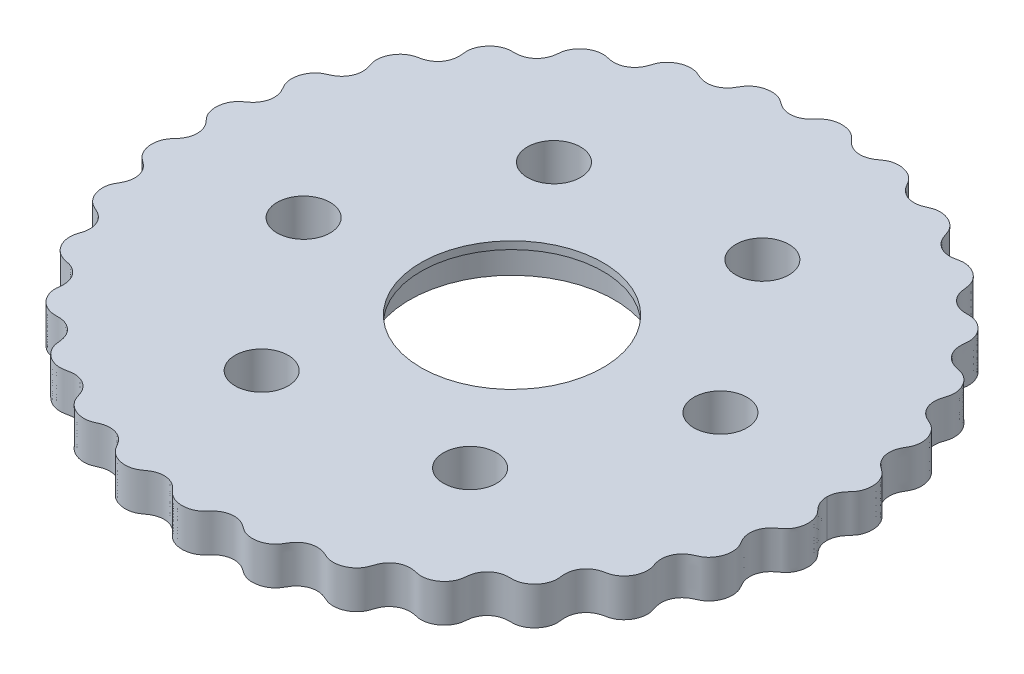
from build123d import *

# Parameters (mm, degrees)
SKETCH1_R           = 13.5
SKETCH1_R_2         = 3.5
BOSS_EXTRUDE1_DEPTH = 5
BOSS_EXTRUDE2_START = -1
SKETCH2_R           = 13.5
SKETCH2_R_2         = 12
BOSS_EXTRUDE2_DEPTH = 1


with BuildPart() as part:
    # Sketch1 → Boss-Extrude1 (new body)
    with BuildSketch(Plane(origin=(0, 0, 0), x_dir=(1, 0, 0), z_dir=(0, 1, 0))):
        with BuildLine():
            add(Edge.make_bspline(
                [(-40.502879456, 0.072075967), (-40.504437979, 0.130996079), (-40.51138778, 0.248395874), (-40.532676958, 0.420060144), (-40.563595901, 0.584575225), (-40.602489077, 0.739823779), (-40.647493865, 0.884373714), (-40.696740736, 1.017464677), (-40.748507566, 1.138919757), (-40.801315678, 1.24901788), (-40.853971517, 1.348358237), (-40.905566865, 1.437737911), (-40.955452736, 1.518053147), (-41.003200154, 1.590226623), (-41.048557281, 1.655158264), (-41.091408772, 1.713695013), (-41.131740315, 1.766614676), (-41.169609386, 1.814619504), (-41.205122093, 1.858336083), (-41.238415444, 1.898319005), (-41.269644122, 1.935056574), (-41.298970883, 1.968977383), (-41.326559757, 2.000457049), (-41.352571378, 2.029824666), (-41.385356076, 2.066550126), (-41.423147749, 2.108542416), (-41.464448335, 2.15435335), (-41.502588583, 2.19688879), (-41.538304261, 2.237181587), (-41.572193873, 2.276058726), (-41.604736385, 2.314190498), (-41.636308372, 2.352126091), (-41.66719947, 2.390319698), (-41.702696921, 2.435621407), (-41.74275206, 2.488987583), (-41.787433101, 2.552040674), (-41.831832015, 2.618765507), (-41.87589404, 2.689657448), (-41.924284254, 2.773454615), (-41.97641295, 2.872431769), (-42.031118653, 2.989178088), (-42.082743569, 3.114690211), (-42.130316107, 3.248712123), (-42.172861536, 3.390760817), (-42.209446628, 3.540153734), (-42.239215184, 3.696033586), (-42.261417612, 3.857394081), (-42.27543466, 4.02310605), (-42.280795973, 4.191944392), (-42.277193708, 4.362615661), (-42.264491401, 4.533786152), (-42.242728201, 4.704110186), (-42.21211854, 4.872258299), (-42.173047296, 5.036944979), (-42.126060473, 5.196955609), (-42.071851388, 5.351172298), (-42.011242336, 5.498598285), (-41.945161595, 5.638380692), (-41.874615525, 5.769831482), (-41.800655342, 5.892446603), (-41.724337781, 6.005923513), (-41.65315005, 6.101489757), (-41.588123412, 6.181754491), (-41.529684961, 6.24905118), (-41.471588, 6.311646259), (-41.413991663, 6.36987325), (-41.356929905, 6.424166958), (-41.306569421, 6.469421444), (-41.262545242, 6.507274988), (-41.224668547, 6.538773169), (-41.18642129, 6.569609232), (-41.147497937, 6.600118511), (-41.107502522, 6.630697696), (-41.065930675, 6.661821977), (-41.022148437, 6.694068788), (-40.975367408, 6.728151191), (-40.933075132, 6.758829314), (-40.896662403, 6.785314335), (-40.867890994, 6.806326942), (-40.837472278, 6.828687952), (-40.80520515, 6.8526265), (-40.770873157, 6.878406434), (-40.734245601, 6.906332265), (-40.695079807, 6.936755941), (-40.653125022, 6.970084426), (-40.608128617, 7.0067879), (-40.559845386, 7.047408235), (-40.508050966, 7.092567068), (-40.45256056, 7.142972336), (-40.393254201, 7.199421457), (-40.330109679, 7.2627985), (-40.263243664, 7.334061571), (-40.192960398, 7.414215591), (-40.119805106, 7.504264806), (-40.044615968, 7.605139616), (-39.968564176, 7.71759443), (-39.893167081, 7.842078482), (-39.82025686, 7.978590483), (-39.75188923, 8.126539641), (-39.690186586, 8.284646601), (-39.637127827, 8.45092184), (-39.594318767, 8.622749866), (-39.562792836, 8.797083135), (-39.542891576, 8.970716981), (-39.534254661, 9.140589965), (-39.535917045, 9.304046435), (-39.546481184, 9.459013321), (-39.564317593, 9.604072511), (-39.587750551, 9.738439325), (-39.61520126, 9.861875733), (-39.64527891, 9.974571352), (-39.676823931, 10.077019673), (-39.708914841, 10.16990725), (-39.74085163, 10.254024228), (-39.772126761, 10.330197813), (-39.80239185, 10.399246398), (-39.831425054, 10.461950381), (-39.859101884, 10.519035516), (-39.885370522, 10.571165089), (-39.910231773, 10.618937972), (-39.933723271, 10.662890366), (-39.955907315, 10.70349966), (-39.976861708, 10.741189367), (-39.996672974, 10.776334444), (-40.021684239, 10.820243954), (-40.050544348, 10.870344333), (-40.082024465, 10.9247734), (-40.11097075, 10.975048666), (-40.13790876, 11.0223924), (-40.16327161, 11.067783475), (-40.187406205, 11.11201258), (-40.210582348, 11.155723144), (-40.233002449, 11.19944198), (-40.258445601, 11.250962314), (-40.286665335, 11.311178152), (-40.317406246, 11.381676129), (-40.347121638, 11.455622576), (-40.37567026, 11.533516358), (-40.40583505, 11.624824094), (-40.436594468, 11.731658585), (-40.466307965, 11.856338966), (-40.491284938, 11.988987768), (-40.510625995, 12.129179167), (-40.523471245, 12.276260633), (-40.529039188, 12.429389439), (-40.526657039, 12.587564484), (-40.515784978, 12.7496577), (-40.496034529, 12.914444588), (-40.467181677, 13.080634469), (-40.429174977, 13.246900346), (-40.382138906, 13.411908286), (-40.326372615, 13.574346064), (-40.262344227, 13.7329508), (-40.190680815, 13.886535246), (-40.112154132, 14.034012415), (-40.027662196, 14.174418207), (-39.938206731, 14.306931737), (-39.844866412, 14.430893111), (-39.748765726, 14.545818429), (-39.651039046, 14.651411928), (-39.552789185, 14.747575245), (-39.463185027, 14.827177479), (-39.382735241, 14.89297488), (-39.311404335, 14.947340166), (-39.241362142, 14.997130926), (-39.17271331, 15.04269605), (-39.105423926, 15.084456847), (-39.046632456, 15.118640298), (-38.995648976, 15.14679194), (-38.952059849, 15.16991814), (-38.908315041, 15.192266129), (-38.864065863, 15.214092621), (-38.81886645, 15.235693295), (-38.772153561, 15.257414801), (-38.723222038, 15.279672085), (-38.671194832, 15.302973689), (-38.62435504, 15.32379454), (-38.584122423, 15.341708303), (-38.552370637, 15.355901573), (-38.518827736, 15.370999547), (-38.483258925, 15.387172682), (-38.445407455, 15.404619851), (-38.404994167, 15.423573956), (-38.361717819, 15.444308554), (-38.31525663, 15.467145584), (-38.265271617, 15.492464209), (-38.211412491, 15.520710676), (-38.153327146, 15.552408878), (-38.090676008, 15.588170956), (-38.023152759, 15.628706743), (-37.950513098, 15.674830091), (-37.872613047, 15.727459061), (-37.789457707, 15.787605691), (-37.701259868, 15.856349743), (-37.608505202, 15.934789895), (-37.512016686, 16.023966187), (-37.413005607, 16.124750195), (-37.31309134, 16.237705808), (-37.214269488, 16.362933874), (-37.118811563, 16.499926922), (-37.029091964, 16.647471009), (-36.947359051, 16.8036333), (-36.87549013, 16.965860538), (-36.814784203, 17.131185371), (-36.765841667, 17.296504474), (-36.728556118, 17.458869661), (-36.702210267, 17.61573184), (-36.685641072, 17.765097285), (-36.677428642, 17.905585137), (-36.676069641, 18.036400662), (-36.680111505, 18.157252639), (-36.688240065, 18.268244742), (-36.699324874, 18.369764488), (-36.712432204, 18.462384398), (-36.726816762, 18.546782031), (-36.741901519, 18.623679955), (-36.757252545, 18.693803598), (-36.772553286, 18.757853637), (-36.787580768, 18.816489388), (-36.802184904, 18.870320105), (-36.816271201, 18.919901655), (-36.829786743, 18.965736692), (-36.84270907, 19.008276968), (-36.855037497, 19.047926813), (-36.866786445, 19.085047178), (-36.881711691, 19.131597379), (-36.899056905, 19.184994051), (-36.918052029, 19.243343483), (-36.935508568, 19.297498426), (-36.951676302, 19.348685212), (-36.966762914, 19.397889825), (-36.980930586, 19.445909195), (-36.99429738, 19.49339003), (-37.009048067, 19.548769885), (-37.024772089, 19.612760421), (-37.040945676, 19.686817628), (-37.055488537, 19.76374034), (-37.068194011, 19.84408625), (-37.078787955, 19.928216235), (-37.087858358, 20.026121024), (-37.093877293, 20.139595162), (-37.094663409, 20.270442037), (-37.088843047, 20.407890765), (-37.075654486, 20.551249677), (-37.054434438, 20.699630613), (-37.024645622, 20.851990842), (-36.985897403, 21.00716946), (-36.937960777, 21.163922366), (-36.880777963, 21.320955369), (-36.814467037, 21.47695596), (-36.739321852, 21.630623652), (-36.655807486, 21.78069879), (-36.564551425, 21.925989597), (-36.46633068, 22.065397193), (-36.362055013, 22.197938281), (-36.252746427, 22.322765205), (-36.139515044, 22.439183077), (-36.023531428, 22.546663683), (-35.905995298, 22.644855923), (-35.788100413, 22.733592552), (-35.670995147, 22.812893053), (-35.555737844, 22.882962529), (-35.452619784, 22.939084609), (-35.361410501, 22.984062492), (-35.281473608, 23.020178645), (-35.203780905, 23.052271422), (-35.128287816, 23.080726218), (-35.054780695, 23.105969116), (-34.990826933, 23.125966354), (-34.935421709, 23.142013837), (-34.888014781, 23.154938029), (-34.840317935, 23.167206648), (-34.791857793, 23.179011771), (-34.742041097, 23.190568936), (-34.690128146, 23.202127905), (-34.635199917, 23.213989457), (-34.585964272, 23.224441119), (-34.533246308, 23.235630641), (-34.487874818, 23.245326321), (-34.438340728, 23.256168388), (-34.398824533, 23.265006323), (-34.356634144, 23.274707098), (-34.311431312, 23.285459313), (-34.262847534, 23.297490986), (-34.210484727, 23.311078237), (-34.153917819, 23.32655549), (-34.092700213, 23.344327173), (-34.026373332, 23.364880681), (-33.954481847, 23.388799984), (-33.876596495, 23.416778654), (-33.792346589, 23.449630187), (-33.701464229, 23.488292251), (-33.603841431, 23.533819971), (-33.499599605, 23.587361779), (-33.38916746, 23.650110276), (-33.273358391, 23.723221025), (-33.153432114, 23.807695581), (-33.031119446, 23.904232676), (-32.90858704, 24.013063537), (-32.788324482, 24.133801291), (-32.672952167, 24.265344535), (-32.564972525, 24.405873705), (-32.46651081, 24.552961062), (-32.379102691, 24.703784071), (-32.303576077, 24.855400118), (-32.240046745, 25.005022859), (-32.18801423, 25.150244995), (-32.14652091, 25.289174744), (-32.11433062, 25.420481263), (-32.090091421, 25.543365979), (-32.072462274, 25.657486684), (-32.060197909, 25.762860744), (-32.052196012, 25.859767325), (-32.047515445, 25.948660623), (-32.045374916, 26.030099372), (-32.045140168, 26.104693376), (-32.046305634, 26.173065302), (-32.048474506, 26.235824942), (-32.051339533, 26.293553042), (-32.05466578, 26.346792088), (-32.058275778, 26.396041965), (-32.062037143, 26.441758863), (-32.065852456, 26.484356259), (-32.069651119, 26.524207128), (-32.074626822, 26.574126729), (-32.080588401, 26.631262298), (-32.087171894, 26.69345454), (-32.093128219, 26.750910492), (-32.098441916, 26.804943057), (-32.103110744, 26.856608749), (-32.107129554, 26.906759899), (-32.110482328, 26.956085119), (-32.113138802, 27.005140759), (-32.115372932, 27.062581086), (-32.116592463, 27.129130619), (-32.115913294, 27.206136988), (-32.112881788, 27.285896728), (-32.107164998, 27.368799849), (-32.097440053, 27.464634978), (-32.081908404, 27.57491105), (-32.058122619, 27.701068616), (-32.026747507, 27.832559609), (-31.987138147, 27.9686227), (-31.938778629, 28.108307062), (-31.881302552, 28.250521331), (-31.814507602, 28.394074888), (-31.738364785, 28.53771632), (-31.653022645, 28.680168706), (-31.558806806, 28.82016252), (-31.456215107, 28.956466138), (-31.345908588, 29.087913965), (-31.228698586, 29.21343202), (-31.105530185, 29.332060775), (-30.977462256, 29.442975002), (-30.845644322, 29.545500363), (-30.711290441, 29.639126479), (-30.575650239, 29.723516212), (-30.439977163, 29.798510886), (-30.305493831, 29.864131204), (-30.173354175, 29.920573575), (-30.044601673, 29.96820158), (-29.93049571, 30.004254692), (-29.830368081, 30.031455673), (-29.743213389, 30.051953784), (-29.659097417, 30.068811273), (-29.577968142, 30.082390022), (-29.499616212, 30.093061316), (-29.432079407, 30.100292169), (-29.374098921, 30.105208262), (-29.32489288, 30.108556245), (-29.275838193, 30.111135718), (-29.226506122, 30.113039098), (-29.176362061, 30.11435498), (-29.124741856, 30.115171028), (-29.070821899, 30.115580071), (-29.013580903, 30.115691409), (-28.962056286, 30.11565741), (-28.9177505, 30.11566371), (-28.882742511, 30.115724412), (-28.845697531, 30.115889609), (-28.806328057, 30.116221355), (-28.764314638, 30.116799274), (-28.719303194, 30.117725637), (-28.670902687, 30.11913172), (-28.618683493, 30.12118569), (-28.562177042, 30.12410226), (-28.500877499, 30.128154356), (-28.434246583, 30.13368687), (-28.361723013, 30.141132408), (-28.282738518, 30.151028472), (-28.196742744, 30.164034868), (-28.103239719, 30.180949043), (-28.001838361, 30.202715608), (-27.89231861, 30.230424446), (-27.774712498, 30.265289906), (-27.649395319, 30.308602331), (-27.517175968, 30.361643823), (-27.379368106, 30.425564341), (-27.237817521, 30.501223359), (-27.094859966, 30.589015987), (-26.953192158, 30.688717324), (-26.815658514, 30.79938762), (-26.684983082, 30.919375899), (-26.563499243, 31.046437746), (-26.452936421, 31.177950197), (-26.354307782, 31.311177419), (-26.267912001, 31.443528675), (-26.193430257, 31.572759498), (-26.130079998, 31.697090642), (-26.076784152, 31.815244964), (-26.032324183, 31.92642003), (-25.995459846, 32.030221028), (-25.965011293, 32.126576726), (-25.939907438, 32.215655074), (-25.919208192, 32.297788233), (-25.902108674, 32.373411274), (-25.887932336, 32.443015115), (-25.876118201, 32.507112266), (-25.866205729, 32.566213131), (-25.857819516, 32.62081051), (-25.85065501, 32.671370165), (-25.844465847, 32.718325723), (-25.839052969, 32.762076561), (-25.834255479, 32.802987649), (-25.829943088, 32.841390661), (-25.824698893, 32.889650841), (-25.81887062, 32.945143965), (-25.812518079, 33.005865414), (-25.806447371, 33.062210808), (-25.800392371, 33.115386264), (-25.794144472, 33.166364244), (-25.787529296, 33.215928413), (-25.780392587, 33.264709189), (-25.771291557, 33.321295661), (-25.759556608, 33.386179732), (-25.744111284, 33.46048029), (-25.725993661, 33.536757091), (-25.704788752, 33.61542629), (-25.68010019, 33.69669868), (-25.648384615, 33.789946229), (-25.607512081, 33.896179583), (-25.554753878, 34.016147161), (-25.493260241, 34.139432768), (-25.422621587, 34.265089757), (-25.342598504, 34.392033571), (-25.253129747, 34.519091045), (-25.154336157, 34.645041905), (-25.046519982, 34.768656704), (-24.930160066, 34.888730857), (-24.805903031, 35.004115459), (-24.674550759, 35.113744869), (-24.537044413, 35.21666108), (-24.394445294, 35.312034736), (-24.247912812, 35.399182641), (-24.098679856, 35.477581546), (-23.948025836, 35.546878004), (-23.797247617, 35.606894082), (-23.647628526, 35.657628667), (-23.500405459, 35.699254133), (-23.356734004, 35.732108067), (-23.217651165, 35.756679684), (-23.084034924, 35.77359048), (-22.967182153, 35.782736971), (-22.865731269, 35.786581157), (-22.778166112, 35.786943529), (-22.694282554, 35.784557019), (-22.613876823, 35.779754633), (-22.536572782, 35.77283707), (-22.470091637, 35.765029784), (-22.412990508, 35.757102642), (-22.364438104, 35.749583991), (-22.315859579, 35.741348234), (-22.266737819, 35.732376703), (-22.21643514, 35.722623294), (-22.164164184, 35.712013628), (-22.108950466, 35.700447247), (-22.059478101, 35.689912215), (-22.017064467, 35.680886981), (-21.983609271, 35.673807348), (-21.948259024, 35.666408445), (-21.910733806, 35.658687677), (-21.87072038, 35.650651403), (-21.827868552, 35.642318846), (-21.781787502, 35.63372722), (-21.732042345, 35.624938329), (-21.678151317, 35.616047024), (-21.619584187, 35.607191862), (-21.555762803, 35.598568344), (-21.486065033, 35.590444995), (-21.409833886, 35.583182325), (-21.326394092, 35.577254267), (-21.235079034, 35.573270885), (-21.13527121, 35.571999905), (-21.026459305, 35.574382881), (-20.908313741, 35.581539531), (-20.78077976, 35.594751524), (-20.644181993, 35.615415507), (-20.499327106, 35.644956097), (-20.347582681, 35.68469477), (-20.190904118, 35.735681404), (-20.031781918, 35.798510679), (-19.873093758, 35.873160916), (-19.717869586, 35.95889993), (-19.569006884, 36.054293686), (-19.42899418, 36.157327935), (-19.299702175, 36.265619756), (-19.182281208, 36.376670174), (-19.077171073, 36.488102256), (-18.984199661, 36.597842054), (-18.902731521, 36.704223332), (-18.831827852, 36.806019518), (-18.77039009, 36.902420348), (-18.717272736, 36.992975034), (-18.671362221, 37.077521273), (-18.631625506, 37.156113875), (-18.597135068, 37.228961009), (-18.567077276, 37.296371563), (-18.540750168, 37.358714152), (-18.517555159, 37.416386691), (-18.496985874, 37.469794773), (-18.478616099, 37.519336987), (-18.462088074, 37.565395465), (-18.447101765, 37.608330236), (-18.433405373, 37.648476287), (-18.420787156, 37.686142457), (-18.405162274, 37.733434604), (-18.387494099, 37.787710608), (-18.368312778, 37.846887905), (-18.350447614, 37.901562815), (-18.333358808, 37.952913305), (-18.316620325, 38.001891191), (-18.299884796, 38.049262819), (-18.282860358, 38.095642374), (-18.265295159, 38.141518891), (-18.243912368, 38.194904513), (-18.217869833, 38.256226044), (-18.185805973, 38.326354603), (-18.150453409, 38.398054532), (-18.111351787, 38.471538809), (-18.063294173, 38.555213537), (-18.004020678, 38.649717988), (-17.930709015, 38.755360623), (-17.848283582, 38.862762043), (-17.756470731, 38.970959972), (-17.655191779, 39.078873182), (-17.544561724, 39.185354295), (-17.424885671, 39.289233247), (-17.296651519, 39.389356024), (-17.160519358, 39.484618485), (-17.01730758, 39.57399611), (-16.867975927, 39.656569771), (-16.713605743, 39.731547647), (-16.555377705, 39.798283231), (-16.39454735, 39.856289333), (-16.232418722, 39.905247975), (-16.07031644, 39.945015999), (-15.909556489, 39.975626249), (-15.751415959, 39.997284124), (-15.597101885, 40.010359287), (-15.447719195, 40.01537225), (-15.304237581, 40.012975444), (-15.167456757, 40.00392824), (-15.048759718, 39.990303709), (-14.946418649, 39.974310667), (-14.858635301, 39.957496846), (-14.775103464, 39.938606393), (-14.695622923, 39.917946925), (-14.619844875, 39.895769765), (-14.555308252, 39.874859286), (-14.500407658, 39.855726778), (-14.454131907, 39.838734451), (-14.40828342, 39.821097383), (-14.362427704, 39.802722987), (-14.316033909, 39.783471712), (-14.268451637, 39.763150052), (-14.218880633, 39.741503991), (-14.166330589, 39.718213925), (-14.1190283, 39.69711343), (-14.078301441, 39.678994219), (-14.046079291, 39.664725196), (-14.011920716, 39.649715756), (-13.975533663, 39.633905868), (-13.936589217, 39.617238926), (-13.894717055, 39.599665442), (-13.849500715, 39.581148086), (-13.800472935, 39.561668459), (-13.747111481, 39.541236069), (-13.688836125, 39.519900016), (-13.625007778, 39.497763954), (-13.554931258, 39.475004782), (-13.477863734, 39.451895342), (-13.393031601, 39.428830864), (-13.299659174, 39.406358023), (-13.197013064, 39.385203972), (-13.084465858, 39.366300601), (-12.961581251, 39.350796512), (-12.828219229, 39.340046487), (-12.684653682, 39.335566469), (-12.531686147, 39.33894346), (-12.370730026, 39.351696189), (-12.203833698, 39.375095234), (-12.033614043, 39.409968558), (-11.863088049, 39.456533872), (-11.695417831, 39.514303947), (-11.53361388, 39.582098004), (-11.380258627, 39.658163785), (-11.237307507, 39.740382179), (-11.105999463, 39.82650468), (-10.986875791, 39.914371982), (-10.879880067, 40.002077317), (-10.784500873, 40.088060556), (-10.699922146, 40.171138456), (-10.625157006, 40.250487348), (-10.559153252, 40.325597239), (-10.50086828, 40.396213613), (-10.449316895, 40.462278309), (-10.403597848, 40.523876146), (-10.362905161, 40.581190255), (-10.326529415, 40.634466693), (-10.293853019, 40.683987615), (-10.264342246, 40.730051688), (-10.237537949, 40.772960288), (-10.213046073, 40.813008171), (-10.190528661, 40.85047746), (-10.169695673, 40.885634038), (-10.15029775, 40.918725657), (-10.12606068, 40.960399742), (-10.098341271, 41.008434736), (-10.067987779, 41.06105565), (-10.039622164, 41.109859606), (-10.012521052, 41.155827737), (-9.986105849, 41.199753143), (-9.959904067, 41.242272127), (-9.933522574, 41.283890644), (-9.902146472, 41.331858903), (-9.864955838, 41.386359735), (-9.820506216, 41.447976698), (-9.772787287, 41.510324689), (-9.721254996, 41.573606972), (-9.665465278, 41.637848569), (-9.598351304, 41.710168436), (-9.517555367, 41.790615131), (-9.420282887, 41.87875072), (-9.313677779, 41.966334575), (-9.197757439, 42.052332837), (-9.072750484, 42.135656423), (-8.939083952, 42.21520907), (-8.797369937, 42.289926653), (-8.648389473, 42.35881141), (-8.493074215, 42.420960925), (-8.332485794, 42.475592562), (-8.167793092, 42.522063444), (-8.000247687, 42.55988608), (-7.831157772, 42.588739651), (-7.661860879, 42.608476909), (-7.493695753, 42.619126617), (-7.327973698, 42.620891455), (-7.165949707, 42.614141266), (-7.00879361, 42.599401498), (-6.857561397, 42.577336626), (-6.713166718, 42.548728235), (-6.576352353, 42.514447269), (-6.447661103, 42.475419689), (-6.337426374, 42.436153963), (-6.243395089, 42.39833631), (-6.163438243, 42.363005227), (-6.087952344, 42.326670857), (-6.016610394, 42.289551073), (-5.948940093, 42.251762912), (-5.891477053, 42.217563534), (-5.842594191, 42.187065456), (-5.801325325, 42.160413756), (-5.760298598, 42.133084475), (-5.719043803, 42.104846068), (-5.676990384, 42.075392168), (-5.633440714, 42.044328917), (-5.587534335, 42.011161708), (-5.546421936, 41.981262281), (-5.511138786, 41.955619872), (-5.483274273, 41.935422282), (-5.453779255, 41.914148512), (-5.422395189, 41.891681606), (-5.388828887, 41.86789944), (-5.352747536, 41.842676934), (-5.313773203, 41.815889393), (-5.271476975, 41.787417346), (-5.22537295, 41.757153397), (-5.174912516, 41.725011669), (-5.119479637, 41.690940558), (-5.058388245, 41.654939562), (-4.990883426, 41.617080927), (-4.916148753, 41.577536641), (-4.833322972, 41.536610736), (-4.741530071, 41.49477583), (-4.639927249, 41.452711031), (-4.527775032, 41.411335741), (-4.404531868, 41.371830555), (-4.269971146, 41.335633121), (-4.124311091, 41.304394948), (-3.968337932, 41.279887093), (-3.803492803, 41.263850779), (-3.631887958, 41.257804157), (-3.456224312, 41.262835459), (-3.279602901, 41.279427934), (-3.1052535, 41.307363577), (-2.936232177, 41.345735564), (-2.775151637, 41.393068409), (-2.623997098, 41.447513723), (-2.484051857, 41.507072155), (-2.355924874, 41.569794207), (-2.239650693, 41.633929124), (-2.134825078, 41.698011717), (-2.04074486, 41.760893368), (-1.956531445, 41.821731911), (-1.881228395, 41.879956649), (-1.813871652, 41.935222152), (-1.753535632, 41.987360335), (-1.69936027, 42.036336443), (-1.650564241, 42.082211549), (-1.606448848, 42.125112249), (-1.566396045, 42.165207146), (-1.529863105, 42.202689188), (-1.496375645, 42.237762792), (-1.465520086, 42.27063473), (-1.436936223, 42.301507886), (-1.41031027, 42.330577148), (-1.377054656, 42.367176769), (-1.339087322, 42.409313678), (-1.297710292, 42.455329066), (-1.25930143, 42.497823442), (-1.222902013, 42.537643019), (-1.187745826, 42.57547509), (-1.153211517, 42.611870841), (-1.118788565, 42.647266221), (-1.084052633, 42.682000148), (-1.042746817, 42.722051661), (-0.993920024, 42.767470732), (-0.935969006, 42.818496583), (-0.874351372, 42.869623674), (-0.808565341, 42.92085318), (-0.730418701, 42.977741336), (-0.637587269, 43.039944687), (-0.527371779, 43.106585866), (-0.408115863, 43.17109783), (-0.279968067, 43.232488558), (-0.14330277, 43.289738207), (0.001302446, 43.341846549), (0.15308776, 43.387871024), (0.31113358, 43.426958966), (0.474384022, 43.458374034), (0.641671746, 43.481517579), (0.811743945, 43.495945162), (0.983289336, 43.501378392), (1.154965836, 43.497712182), (1.325428628, 43.485017457), (1.493358252, 43.463539328), (1.657488389, 43.433690723), (1.816633005, 43.396041447), (1.969712556, 43.351302578), (2.115779054, 43.300306075), (2.254039838, 43.243979325), (2.38388012, 43.183314201), (2.504884531, 43.119329912), (2.607527179, 43.058553587), (2.69429118, 43.002290068), (2.767451141, 42.951213389), (2.835892896, 42.899978712), (2.89992877, 42.84878168), (2.959984527, 42.797704827), (3.010325194, 42.75235155), (3.052620996, 42.712532372), (3.087936, 42.678168037), (3.122618466, 42.643374772), (3.157031424, 42.607886691), (3.191607768, 42.571354942), (3.226868964, 42.533331726), (3.26345055, 42.493251816), (3.302137499, 42.45041142), (3.336950691, 42.411689591), (3.366975465, 42.37837244), (3.390773867, 42.35206281), (3.416067758, 42.324268815), (3.443103489, 42.29481534), (3.472163126, 42.263515538), (3.503570195, 42.23017248), (3.53769613, 42.194582), (3.574967358, 42.156537219), (3.615872793, 42.115835363), (3.66097132, 42.072287626), (3.710898518, 42.025733017), (3.766371423, 41.976057231), (3.828189444, 41.923217604), (3.897228746, 41.867275006), (3.974426377, 41.808432901), (4.060749458, 41.747082548), (4.157144144, 41.683851146), (4.264459485, 41.619646519), (4.383343735, 41.555687888), (4.514116039, 41.493508292), (4.656625326, 41.434912292), (4.810119563, 41.381875437), (4.973158751, 41.336382273), (5.143607973, 41.300217452), (5.318736557, 41.274745156), (5.495424447, 41.260726167), (5.670444435, 41.258219809), (5.84076316, 41.266596769), (6.003797725, 41.284656337), (6.157581544, 41.310812809), (6.300823314, 41.343302854), (6.432872236, 41.380370943), (6.553620134, 41.420406848), (6.663374543, 41.46202786), (6.762730368, 41.504112117), (6.852457325, 41.545795999), (6.933410811, 41.586449422), (7.006467002, 41.625640492), (7.072479254, 41.663097534), (7.132251392, 41.698673317), (7.186523417, 41.732313885), (7.235965783, 41.764032777), (7.281179234, 41.793890505), (7.322698002, 41.821978698), (7.360994823, 41.848408146), (7.39648677, 41.873299992), (7.429541262, 41.896779377), (7.460481856, 41.918970966), (7.499297562, 41.947004204), (7.543884457, 41.979421201), (7.592778095, 42.014965571), (7.638374341, 42.047871354), (7.681718832, 42.07873348), (7.723651789, 42.108034715), (7.76485517, 42.136158548), (7.805887234, 42.163402451), (7.854095042, 42.194421544), (7.910311687, 42.229051256), (7.976099184, 42.267234), (8.045197604, 42.304756185), (8.118179442, 42.341576616), (8.195454574, 42.377533336), (8.286390178, 42.416246791), (8.393157181, 42.456794379), (8.518123203, 42.497629703), (8.651380815, 42.534136603), (8.792486679, 42.565378132), (8.940782963, 42.59045407), (9.095428525, 42.608539371), (9.255427101, 42.61891445), (9.419655947, 42.620989713), (9.586894365, 42.614324433), (9.755852515, 42.598640512), (9.925200292, 42.573831351), (10.093596115, 42.539965996), (10.259715324, 42.497288705), (10.422277876, 42.446214018), (10.580075002, 42.387317417), (10.731994479, 42.321321624), (10.877044201, 42.249078561), (11.014373776, 42.171546918), (11.14329391, 42.089765208), (11.263293458, 42.004819996), (11.374054129, 41.917808773), (11.475463048, 41.829796535), (11.559943639, 41.749100523), (11.63024342, 41.676333232), (11.688729626, 41.611568796), (11.742737282, 41.547711467), (11.792657267, 41.48482187), (11.838972598, 41.422807886), (11.877460914, 41.368206323), (11.909648938, 41.32045636), (11.936471058, 41.279301454), (11.962815185, 41.237604434), (11.989019975, 41.194956465), (12.015486304, 41.150838313), (12.042696936, 41.104597653), (12.071244394, 41.055422127), (12.096766512, 41.01116006), (12.118702193, 40.973162242), (12.136060681, 40.943188792), (12.154492396, 40.911544355), (12.174189274, 40.87801467), (12.195373407, 40.842366634), (12.218302611, 40.804348371), (12.243276907, 40.763690177), (12.270645969, 40.720106743), (12.300817504, 40.673301222), (12.334266394, 40.622971894), (12.371544208, 40.568822386), (12.413288318, 40.510576635), (12.460229335, 40.447999954), (12.513194783, 40.380927667), (12.573105974, 40.309302513), (12.640963794, 40.233221372), (12.717817978, 40.15299028), (12.804713741, 40.069184068), (12.902610233, 39.982703004), (13.012268279, 39.89481389), (13.134111455, 39.807158473), (13.268074897, 39.721710184), (13.413468757, 39.640664565), (13.568893105, 39.566261649), (13.7322415, 39.500559308), (13.900815832, 39.445198363), (14.071546347, 39.401212473), (14.241278081, 39.36892929), (14.407063393, 39.347984186), (14.566400654, 39.337434763), (14.717380236, 39.335938496), (14.858729245, 39.341947111), (14.989772088, 39.353879054), (15.110337078, 39.370248099), (15.220639927, 39.38974276), (15.321167819, 39.411262615), (15.412578284, 39.433922845), (15.495618875, 39.457038728), (15.571068034, 39.480099782), (15.639694539, 39.502740399), (15.70223175, 39.524711202), (15.759362889, 39.545853375), (15.811714056, 39.566076853), (15.859852434, 39.585342495), (15.904287736, 39.603647896), (15.945475559, 39.621016347), (15.983821708, 39.637488397), (16.01968691, 39.653115494), (16.064626377, 39.672901882), (16.116122006, 39.695818201), (16.172347349, 39.720892178), (16.224510808, 39.743981836), (16.273816089, 39.765466301), (16.321230008, 39.785657744), (16.367534415, 39.804803162), (16.41336509, 39.823089732), (16.459241178, 39.840651455), (16.513311863, 39.8603968), (16.576474735, 39.881983578), (16.650295164, 39.904973594), (16.727528534, 39.926558262), (16.808626344, 39.946531189), (16.903345363, 39.966624676), (17.013665413, 39.985572223), (17.141686837, 40.00146602), (17.277088309, 40.011711421), (17.419323486, 40.015464038), (17.567629621, 40.011947057), (17.72106741, 40.000485129), (17.878555555, 39.980530413), (18.038904354, 39.951682694), (18.200847872, 39.913703821), (18.363075291, 39.866526971), (18.524261344, 39.810261023), (18.683095758, 39.745190258), (18.838311442, 39.6717696), (18.98871118, 39.59061554), (19.133192491, 39.502492926), (19.270770352, 39.408297719), (19.400597461, 39.309035844), (19.521981755, 39.205798157), (19.634400904, 39.099731502), (19.737513588, 38.99200566), (19.831167398, 38.883775768), (19.915403305, 38.776139436), (19.98420237, 38.678924895), (20.040365272, 38.592302286), (20.086242736, 38.515953541), (20.127759229, 38.441384111), (20.165281977, 38.368640287), (20.199235865, 38.2976175), (20.226676036, 38.235753296), (20.249045806, 38.18219379), (20.26727903, 38.136437777), (20.284772743, 38.090526203), (20.301752038, 38.044062736), (20.318472611, 37.996545638), (20.335231608, 37.947345264), (20.352383805, 37.895676449), (20.367368878, 37.849749742), (20.383222408, 37.800913268), (20.396767999, 37.759164675), (20.41160093, 37.713912218), (20.423505381, 37.677978397), (20.436346502, 37.639786928), (20.450309725, 37.599049271), (20.465615048, 37.555450756), (20.482524226, 37.508650686), (20.501349248, 37.458283791), (20.522462102, 37.403963684), (20.546305768, 37.345289244), (20.573406061, 37.281855097), (20.604383617, 37.213267689), (20.639964633, 37.139168691), (20.680988127, 37.059267637), (20.728406256, 36.973385449), (20.783272816, 36.881509669), (20.846713631, 36.783860342), (20.919871764, 36.680962183), (21.003821246, 36.573713827), (21.099446816, 36.463439058), (21.207294991, 36.351899751), (21.327413738, 36.241248937), (21.459211444, 36.13390876), (21.601374914, 36.032374311), (21.751883336, 35.938967918), (21.908136149, 35.855590742), (22.067181293, 35.783527641), (22.225998976, 35.723349789), (22.381779879, 35.674930839), (22.532142954, 35.637559639), (22.675261941, 35.610110189), (22.809898421, 35.591224643), (22.935360818, 35.579474813), (23.051417959, 35.573483592), (23.158194402, 35.572002458), (23.256067551, 35.573950728), (23.345578162, 35.578426358), (23.427358946, 35.584698297), (23.502081409, 35.592188663), (23.570418674, 35.60045065), (23.633021122, 35.609145948), (23.690501693, 35.618023785), (23.743428094, 35.626902592), (23.792319751, 35.635654562), (23.837647827, 35.644193019), (23.879837149, 35.652462278), (23.919269208, 35.660429635), (23.968624493, 35.670628943), (24.025055558, 35.682570965), (24.086426877, 35.695664506), (24.1430974, 35.707634542), (24.196385518, 35.718603116), (24.247350929, 35.728679211), (24.296848773, 35.737947826), (24.345571118, 35.746466098), (24.394078919, 35.754263127), (24.450951239, 35.762521569), (24.516965252, 35.770729801), (24.593551976, 35.778152719), (24.673109381, 35.783530764), (24.756065275, 35.786574755), (24.852286593, 35.787001006), (24.963465204, 35.783182683), (25.091296045, 35.772840475), (25.225235337, 35.755522672), (25.364597653, 35.730506518), (25.508494704, 35.697177203), (25.655881997, 35.655053493), (25.805598443, 35.603806663), (25.956403687, 35.5432738), (26.107012803, 35.473465789), (26.256129101, 35.394570383), (26.402475011, 35.306950642), (26.544821036, 35.21113899), (26.682012589, 35.107827134), (26.812994488, 34.997852063), (26.936832824, 34.882178341), (27.052733947, 34.7618769), (27.160060253, 34.638100491), (27.258342506, 34.512055913), (27.347288436, 34.38497304), (27.42678734, 34.25807053), (27.496910476, 34.132517863), (27.557907019, 34.009393004), (27.605838053, 33.899614324), (27.643481811, 33.802809467), (27.673082801, 33.718208433), (27.698736556, 33.636247505), (27.720807667, 33.556916336), (27.739686682, 33.480049938), (27.753995645, 33.413597088), (27.764989196, 33.356423844), (27.77349479, 33.307827592), (27.781215128, 33.259315637), (27.788286728, 33.210474914), (27.794853223, 33.160787451), (27.801070598, 33.109607323), (27.807116196, 33.056131812), (27.813203672, 32.999364897), (27.818540036, 32.948287015), (27.823156464, 32.904391738), (27.82685519, 32.869725441), (27.830864464, 32.833064465), (27.835274649, 32.794131565), (27.840196556, 32.752619733), (27.845766689, 32.708190045), (27.852153714, 32.660469947), (27.859566344, 32.609052392), (27.868262861, 32.553496346), (27.878562391, 32.493329475), (27.890857961, 32.428054072), (27.905631071, 32.357157674), (27.923467095, 32.280130184), (27.945070113, 32.196489709), (27.971274731, 32.105819475), (28.003051003, 32.007817977), (28.041496871, 31.902363468), (28.087810855, 31.789591554), (28.143236774, 31.669980583), (28.208973414, 31.544433605), (28.286046607, 31.414338776), (28.375150601, 31.281584521), (28.476479068, 31.148505519), (28.589580237, 31.017744683), (28.713278139, 30.892036234), (28.84569555, 30.773941143), (28.984391056, 30.665587764), (29.126589665, 30.568475334), (29.269457833, 30.483381278), (29.41036327, 30.410381823), (29.547071061, 30.348964026), (29.677852741, 30.298189014), (29.801511051, 30.256864831), (29.917340544, 30.22369824), (30.02505021, 30.19740986), (30.124671634, 30.176809904), (30.216469364, 30.160839745), (30.300862924, 30.148587793), (30.378364195, 30.139288261), (30.44953021, 30.132309947), (30.514929487, 30.12714016), (30.575119315, 30.123367218), (30.6306314, 30.120663503), (30.681963587, 30.118770128), (30.729575857, 30.11748365), (30.77388918, 30.116644862), (30.815286217, 30.116129549), (30.854113138, 30.115840971), (30.902871707, 30.11565808), (30.958887661, 30.115657099), (31.020136426, 30.115689786), (31.076951177, 30.115551655), (31.130569451, 30.115102347), (31.181988374, 30.1142352), (31.232012138, 30.112858386), (31.281289169, 30.110884364), (31.338516627, 30.107780854), (31.404247882, 30.102935963), (31.479706699, 30.095399594), (31.557395494, 30.085421437), (31.637777386, 30.072632484), (31.72110814, 30.056660519), (31.817073972, 30.034971502), (31.926906947, 30.005555923), (32.051643895, 29.965780565), (32.180609178, 29.917675539), (32.31290759, 29.860731757), (32.447488025, 29.794594652), (32.583191795, 29.719077377), (32.718793577, 29.634169136), (32.853039268, 29.540038576), (32.984680407, 29.437032627), (33.112505787, 29.32567105), (33.235370258, 29.206636934), (33.352220688, 29.080763429), (33.462118925, 28.949016964), (33.564261572, 28.812477232), (33.657996346, 28.672314188), (33.742834769, 28.529762319), (33.818460958, 28.386092386), (33.884736254, 28.242580775), (33.941699428, 28.100476487), (33.989562191, 27.960965634), (34.028699681, 27.825133015), (34.059635555, 27.693919953), (34.081072394, 27.57856383), (34.095603538, 27.477975055), (34.10520122, 27.390840494), (34.111671189, 27.307082299), (34.115366105, 27.226536656), (34.116624871, 27.148865857), (34.11585445, 27.081888594), (34.113974795, 27.024249347), (34.11160055, 26.97517204), (34.108514198, 26.926011429), (34.104751804, 26.876255511), (34.100334712, 26.825270468), (34.095271649, 26.772271915), (34.08956463, 26.716288236), (34.084278518, 26.666142501), (34.079750855, 26.623175459), (34.076216993, 26.589299742), (34.072562063, 26.553526084), (34.068811946, 26.515578159), (34.065004619, 26.475147693), (34.061194356, 26.431891242), (34.057457096, 26.385427069), (34.053897255, 26.335332375), (34.050656278, 26.281141292), (34.047923238, 26.222344288), (34.04594776, 26.158389865), (34.045055409, 26.088689824), (34.045665433, 26.012629824), (34.048310261, 25.92958744), (34.053655333, 25.838960409), (34.062516623, 25.740208009), (34.07587149, 25.63290821), (34.094856431, 25.516831973), (34.120743261, 25.392033118), (34.154884227, 25.258947195), (34.198617951, 25.118485624), (34.253133794, 24.97210354), (34.319303258, 24.821814166), (34.397502187, 24.67012405), (34.487461907, 24.519876067), (34.588192968, 24.374010945), (34.698014728, 24.235286006), (34.814697314, 24.106009206), (34.935689201, 23.987846068), (35.058378965, 23.881735259), (35.180334748, 23.787915512), (35.29947982, 23.706037711), (35.41418738, 23.635321847), (35.523300616, 23.574720283), (35.62609772, 23.523060393), (35.722225112, 23.479153594), (35.811618847, 23.441868927), (35.894428016, 23.410175987), (35.970947813, 23.383164576), (36.041565312, 23.360048469), (36.106717996, 23.340159462), (36.166863586, 23.322936198), (36.222459087, 23.307910871), (36.273946976, 23.294695679), (36.321746685, 23.282970104), (36.366249874, 23.272469531), (36.407818333, 23.262975394), (36.446783637, 23.254306812), (36.495669355, 23.243649207), (36.551719441, 23.231695738), (36.612782378, 23.218763252), (36.669177615, 23.206687258), (36.722143151, 23.195049822), (36.772678314, 23.183523963), (36.821588235, 23.171842478), (36.869519694, 23.159778066), (36.916989846, 23.147130522), (36.972312336, 23.131483297), (37.035995586, 23.112047114), (37.109048151, 23.087562575), (37.183997899, 23.059983234), (37.261109883, 23.028872507), (37.349286159, 22.989941273), (37.449403348, 22.941011296), (37.562070806, 22.879309117), (37.677456136, 22.80873578), (37.794634121, 22.72891516), (37.912539806, 22.639652461), (38.030021301, 22.540938541), (38.145883487, 22.432950972), (38.258927394, 22.316050893), (38.367985025, 22.190776079), (38.471950458, 22.057830292), (38.56980732, 21.918069195), (38.660652716, 21.772483052), (38.74371753, 21.622176517), (38.818382989, 21.468345813), (38.884193328, 21.312253586), (38.940864374, 21.155201761), (38.988287851, 20.99850264), (39.026531211, 20.843448478), (39.055832731, 20.69127965), (39.076591626, 20.543151404), (39.089352789, 20.400098968), (39.094785701, 20.26300044), (39.093750885, 20.14340837), (39.088629271, 20.039841987), (39.081151982, 19.95067864), (39.071156328, 19.86552891), (39.058969952, 19.784229422), (39.04488054, 19.706463851), (39.030866543, 19.640033786), (39.017607609, 19.583394862), (39.005571283, 19.53557514), (38.992850205, 19.488128109), (38.979399024, 19.440615453), (38.965135933, 19.392498901), (38.949938119, 19.343116672), (38.933638349, 19.291652968), (38.916023987, 19.237097884), (38.900038147, 19.188011988), (38.886324499, 19.145778387), (38.875541321, 19.112383341), (38.864226635, 19.077006422), (38.852350846, 19.039353517), (38.839891354, 18.999094519), (38.826836601, 18.955859206), (38.813191469, 18.909233055), (38.798984351, 18.858753285), (38.78427634, 18.803905566), (38.76917295, 18.744122095), (38.753838841, 18.678782059), (38.738515858, 18.607215973), (38.723544469, 18.528715894), (38.709388125, 18.44255419), (38.696659133, 18.348014066), (38.686143177, 18.244435416), (38.678817532, 18.13127918), (38.675855525, 18.008211745), (38.67860732, 17.875207324), (38.688545957, 17.732660041), (38.707169433, 17.581489115), (38.735856625, 17.423211748), (38.775687778, 17.259953338), (38.827257066, 17.094368559), (38.890518981, 16.929463596), (38.964713248, 16.768337277), (39.048398397, 16.613887326), (39.139594636, 16.468543609), (39.236004227, 16.33408376), (39.335257338, 16.211560226), (39.435131237, 16.101334636), (39.533707789, 16.003189906), (39.629457608, 15.91648066), (39.721258751, 15.840286802), (39.808368259, 15.773546938), (39.890366799, 15.715160983), (39.96709318, 15.664060898), (40.038580143, 15.619253904), (40.104997782, 15.579844642), (40.166607119, 15.545042646), (40.223724034, 15.514160469), (40.276692422, 15.486606446), (40.325865032, 15.461874853), (40.371590317, 15.439535232), (40.414203847, 15.419221946), (40.454023056, 15.400624523), (40.491344364, 15.383479061), (40.526441953, 15.36756075), (40.570609527, 15.347716385), (40.621472431, 15.32507857), (40.677155207, 15.300316914), (40.728789345, 15.277159967), (40.777434728, 15.254985229), (40.823947645, 15.233296152), (40.869016125, 15.211686435), (40.913189254, 15.189815823), (40.964186533, 15.163656408), (41.022271319, 15.132416603), (41.088175054, 15.094724669), (41.155138083, 15.053872156), (41.223424813, 15.009337053), (41.293110774, 14.960678392), (41.372014398, 14.901623557), (41.46043565, 14.82983391), (41.558238698, 14.74248352), (41.656487195, 14.645797704), (41.754153104, 14.539681743), (41.850130391, 14.424245323), (41.943284297, 14.299794862), (42.032491953, 14.166824391), (42.116678193, 14.026003156), (42.194846385, 13.878160481), (42.266104969, 13.724267845), (42.329689775, 13.565418412), (42.384982223, 13.40280429), (42.431523343, 13.237691802), (42.469023572, 13.071395113), (42.497368208, 12.90524853), (42.516618406, 12.740577811), (42.52700757, 12.578670747), (42.528932964, 12.42074728), (42.522942329, 12.267929245), (42.509715162, 12.121209752), (42.490038221, 11.981421923), (42.464774546, 11.849206394), (42.437320741, 11.735328876), (42.409594529, 11.637730417), (42.382856021, 11.554404929), (42.354645091, 11.475426919), (42.325214428, 11.400497588), (42.294732323, 11.329163783), (42.266749955, 11.268382841), (42.241552041, 11.216545968), (42.219384057, 11.172702272), (42.196522677, 11.129045542), (42.172789039, 11.085087623), (42.147940724, 11.040233645), (42.121661953, 10.993754433), (42.093554116, 10.944749967), (42.068199021, 10.900875294), (42.04646372, 10.863245682), (42.029354719, 10.833545172), (42.011352585, 10.802129905), (41.992368228, 10.768733025), (41.972310874, 10.733053029), (41.951090704, 10.694749069), (41.92862265, 10.653435867), (41.904831688, 10.608678403), (41.879660109, 10.55998663), (41.85307729, 10.50681071), (41.825092605, 10.448537519), (41.795772116, 10.384489563), (41.765259632, 10.313928022), (41.733802424, 10.236062245), (41.701781319, 10.15006884), (41.669743764, 10.055124199), (41.63843673, 9.950454641), (41.60883376, 9.835407939), (41.582147435, 9.709547858), (41.559815573, 9.572768865), (41.5434482, 9.425420732), (41.534724899, 9.268423061), (41.53524078, 9.103340467), (41.546314433, 8.932385313), (41.568789557, 8.758322156), (41.602875586, 8.584269165), (41.648072436, 8.413422177), (41.703205797, 8.248754429), (41.766567893, 8.092755529), (41.836128112, 7.947260589), (41.909762208, 7.813390927), (41.98545281, 7.691595889), (42.061432056, 7.581764042), (42.136258591, 7.483366139), (42.208837516, 7.395598393), (42.27839978, 7.317506222), (42.34445834, 7.248079888), (42.406755116, 7.186321569), (42.465208239, 7.131287843), (42.519864891, 7.082113205), (42.570861991, 7.038020124), (42.618395055, 6.998320252), (42.662694483, 6.962410305), (42.704008129, 6.929765054), (42.742588883, 6.899929086), (42.778686147, 6.872508344), (42.81254021, 6.847162039), (42.844378752, 6.823595246), (42.884426926, 6.794204663), (42.930481587, 6.760710579), (42.980737345, 6.724251064), (43.027141128, 6.690412775), (43.070642129, 6.658322889), (43.11201026, 6.627285466), (43.151863928, 6.596735854), (43.190694487, 6.566208604), (43.228887053, 6.535314568), (43.273046405, 6.498459484), (43.323319491, 6.454707641), (43.380113232, 6.40249295), (43.437387316, 6.346656607), (43.495199583, 6.286696714), (43.559934381, 6.215057384), (43.631498316, 6.129391591), (43.709308344, 6.026921061), (43.785964145, 5.915238472), (43.860465103, 5.794383473), (43.931758307, 5.664617718), (43.998788274, 5.526407316), (44.060537109, 5.380405991), (44.116059017, 5.227436134), (44.164509138, 5.068468253), (44.20516749, 4.904598543), (44.237458198, 4.737024791), (44.260964176, 4.5670208), (44.275437324, 4.395909639), (44.280804234, 4.225036032), (44.277167405, 4.055738232), (44.264801897, 3.889319723), (44.244147374, 3.72702108), (44.215795425, 3.569992262), (44.180471991, 3.41926554), (44.139014644, 3.275729177), (44.092344282, 3.140101771), (44.041430562, 3.01290693), (43.991765029, 2.904319169), (43.944910973, 2.812009988), (43.901781678, 2.733789704), (43.857995189, 2.66025117), (43.813780924, 2.591107191), (43.769268422, 2.525946393), (43.729433779, 2.471070861), (43.694265686, 2.424797212), (43.663796286, 2.386054423), (43.632841523, 2.347909411), (43.60117755, 2.309976019), (43.568505804, 2.271790585), (43.534439135, 2.232791911), (43.498486171, 2.192294285), (43.460034036, 2.149450553), (43.425281195, 2.110909671), (43.395398277, 2.0776992), (43.371815593, 2.051396913), (43.346923992, 2.023470964), (43.320575738, 1.993660648), (43.292615036, 1.961668915), (43.262880182, 1.927156877), (43.231206962, 1.889737724), (43.197433738, 1.848970191), (43.161408807, 1.804351805), (43.123000736, 1.755312432), (43.082112507, 1.701208903), (43.038700377, 1.641322004), (42.992798344, 1.57485774), (42.944548787, 1.500955588), (42.894239223, 1.418707372), (42.842343791, 1.327191269), (42.789565932, 1.225525872), (42.736875667, 1.112948597), (42.685531094, 0.988920097), (42.637070294, 0.853250822), (42.593258496, 0.706237044), (42.555978969, 0.548782726), (42.527066756, 0.382474227), (42.508102029, 0.209572887), (42.500199442, 0.032901784), (42.5, 0)],
                knots=[3141, 3141, 3141, 3141, 3142, 3143, 3144, 3145, 3146, 3147, 3148, 3149, 3150, 3151, 3152, 3153, 3154, 3155, 3156, 3157, 3158, 3159, 3160, 3161, 3162, 3163, 3164, 3166, 3168, 3170, 3172, 3174, 3176, 3178, 3180, 3182, 3185, 3188, 3191, 3194, 3197, 3201, 3205, 3209, 3213, 3217, 3221, 3225, 3229, 3233, 3237, 3241, 3245, 3249, 3253, 3257, 3261, 3265, 3269, 3273, 3277, 3281, 3285, 3289, 3292, 3295, 3298, 3301, 3304, 3307, 3309, 3311, 3313, 3315, 3317, 3319, 3321, 3323, 3325, 3326, 3327, 3328, 3329, 3330, 3331, 3332, 3333, 3334, 3335, 3336, 3337, 3338, 3339, 3340, 3341, 3342, 3343, 3344, 3345, 3346, 3347, 3348, 3349, 3350, 3351, 3352, 3353, 3354, 3355, 3356, 3357, 3358, 3359, 3360, 3361, 3362, 3363, 3364, 3365, 3366, 3367, 3368, 3369, 3370, 3371, 3372, 3373, 3375, 3377, 3379, 3381, 3383, 3385, 3387, 3389, 3391, 3394, 3397, 3400, 3403, 3406, 3410, 3414, 3418, 3422, 3426, 3430, 3434, 3438, 3442, 3446, 3450, 3454, 3458, 3462, 3466, 3470, 3474, 3478, 3482, 3486, 3490, 3494, 3498, 3501, 3504, 3507, 3510, 3513, 3516, 3518, 3520, 3522, 3524, 3526, 3528, 3530, 3532, 3534, 3535, 3536, 3537, 3538, 3539, 3540, 3541, 3542, 3543, 3544, 3545, 3546, 3547, 3548, 3549, 3550, 3551, 3552, 3553, 3554, 3555, 3556, 3557, 3558, 3559, 3560, 3561, 3562, 3563, 3564, 3565, 3566, 3567, 3568, 3569, 3570, 3571, 3572, 3573, 3574, 3575, 3576, 3577, 3578, 3579, 3580, 3581, 3582, 3583, 3585, 3587, 3589, 3591, 3593, 3595, 3597, 3599, 3602, 3605, 3608, 3611, 3614, 3617, 3621, 3625, 3629, 3633, 3637, 3641, 3645, 3649, 3653, 3657, 3661, 3665, 3669, 3673, 3677, 3681, 3685, 3689, 3693, 3697, 3701, 3705, 3709, 3712, 3715, 3718, 3721, 3724, 3727, 3729, 3731, 3733, 3735, 3737, 3739, 3741, 3743, 3744, 3746, 3747, 3748, 3749, 3750, 3751, 3752, 3753, 3754, 3755, 3756, 3757, 3758, 3759, 3760, 3761, 3762, 3763, 3764, 3765, 3766, 3767, 3768, 3769, 3770, 3771, 3772, 3773, 3774, 3775, 3776, 3777, 3778, 3779, 3780, 3781, 3782, 3783, 3784, 3785, 3786, 3787, 3788, 3789, 3790, 3791, 3792, 3794, 3796, 3798, 3800, 3802, 3804, 3806, 3808, 3810, 3813, 3816, 3819, 3822, 3825, 3829, 3833, 3837, 3841, 3845, 3849, 3853, 3857, 3861, 3865, 3869, 3873, 3877, 3881, 3885, 3889, 3893, 3897, 3901, 3905, 3909, 3913, 3917, 3920, 3923, 3926, 3929, 3932, 3935, 3937, 3939, 3941, 3943, 3945, 3947, 3949, 3951, 3953, 3954, 3955, 3956, 3957, 3958, 3959, 3960, 3961, 3962, 3963, 3964, 3965, 3966, 3967, 3968, 3969, 3970, 3971, 3972, 3973, 3974, 3975, 3976, 3977, 3978, 3979, 3980, 3981, 3982, 3983, 3984, 3985, 3986, 3987, 3988, 3989, 3990, 3991, 3992, 3993, 3994, 3995, 3996, 3997, 3998, 3999, 4000, 4001, 4002, 4004, 4006, 4008, 4010, 4012, 4014, 4016, 4018, 4021, 4024, 4027, 4030, 4033, 4036, 4040, 4044, 4048, 4052, 4056, 4060, 4064, 4068, 4072, 4076, 4080, 4084, 4088, 4092, 4096, 4100, 4104, 4108, 4112, 4116, 4120, 4124, 4128, 4131, 4134, 4137, 4140, 4143, 4146, 4148, 4150, 4152, 4154, 4156, 4158, 4160, 4162, 4163, 4164, 4165, 4166, 4167, 4168, 4169, 4170, 4171, 4172, 4173, 4174, 4175, 4176, 4177, 4178, 4179, 4180, 4181, 4182, 4183, 4184, 4185, 4186, 4187, 4188, 4189, 4190, 4191, 4192, 4193, 4194, 4195, 4196, 4197, 4198, 4199, 4200, 4201, 4202, 4203, 4204, 4205, 4206, 4207, 4208, 4209, 4210, 4211, 4213, 4215, 4217, 4219, 4221, 4223, 4225, 4227, 4229, 4232, 4235, 4238, 4241, 4244, 4248, 4252, 4256, 4260, 4264, 4268, 4272, 4276, 4280, 4284, 4288, 4292, 4296, 4300, 4304, 4308, 4312, 4316, 4320, 4324, 4328, 4332, 4336, 4339, 4342, 4345, 4348, 4351, 4354, 4356, 4358, 4360, 4362, 4364, 4366, 4368, 4370, 4372, 4373, 4374, 4375, 4376, 4377, 4378, 4379, 4380, 4381, 4382, 4383, 4384, 4385, 4386, 4387, 4388, 4389, 4390, 4391, 4392, 4393, 4394, 4395, 4396, 4397, 4398, 4399, 4400, 4401, 4402, 4403, 4404, 4405, 4406, 4407, 4408, 4409, 4410, 4411, 4412, 4413, 4414, 4415, 4416, 4417, 4418, 4419, 4420, 4421, 4423, 4425, 4427, 4429, 4431, 4433, 4435, 4437, 4440, 4443, 4446, 4449, 4452, 4455, 4459, 4463, 4467, 4471, 4475, 4479, 4483, 4487, 4491, 4495, 4499, 4503, 4507, 4511, 4515, 4519, 4523, 4527, 4531, 4535, 4539, 4543, 4547, 4550, 4553, 4556, 4559, 4562, 4565, 4567, 4569, 4571, 4573, 4575, 4577, 4579, 4581, 4582, 4583, 4584, 4585, 4586, 4587, 4588, 4589, 4590, 4591, 4592, 4593, 4594, 4595, 4596, 4597, 4598, 4599, 4600, 4601, 4602, 4603, 4604, 4605, 4606, 4607, 4608, 4609, 4610, 4611, 4612, 4613, 4614, 4615, 4616, 4617, 4618, 4619, 4620, 4621, 4622, 4623, 4624, 4625, 4626, 4627, 4628, 4629, 4630, 4632, 4634, 4636, 4638, 4640, 4642, 4644, 4646, 4648, 4651, 4654, 4657, 4660, 4663, 4667, 4671, 4675, 4679, 4683, 4687, 4691, 4695, 4699, 4703, 4707, 4711, 4715, 4719, 4723, 4727, 4731, 4735, 4739, 4743, 4747, 4751, 4755, 4758, 4761, 4764, 4767, 4770, 4773, 4775, 4777, 4779, 4781, 4783, 4785, 4787, 4789, 4791, 4792, 4793, 4794, 4795, 4796, 4797, 4798, 4799, 4800, 4801, 4802, 4803, 4804, 4805, 4806, 4807, 4808, 4809, 4810, 4811, 4812, 4813, 4814, 4815, 4816, 4817, 4818, 4819, 4820, 4821, 4822, 4823, 4824, 4825, 4826, 4827, 4828, 4829, 4830, 4831, 4832, 4833, 4834, 4835, 4836, 4837, 4838, 4839, 4840, 4842, 4844, 4846, 4848, 4850, 4852, 4854, 4856, 4859, 4862, 4865, 4868, 4871, 4874, 4878, 4882, 4886, 4890, 4894, 4898, 4902, 4906, 4910, 4914, 4918, 4922, 4926, 4930, 4934, 4938, 4942, 4946, 4950, 4954, 4958, 4962, 4966, 4969, 4972, 4975, 4978, 4981, 4984, 4986, 4988, 4990, 4992, 4994, 4996, 4998, 5000, 5001, 5002, 5003, 5004, 5005, 5006, 5007, 5008, 5009, 5010, 5011, 5012, 5013, 5014, 5015, 5016, 5017, 5018, 5019, 5020, 5021, 5022, 5023, 5024, 5025, 5026, 5027, 5028, 5029, 5030, 5031, 5032, 5033, 5034, 5035, 5036, 5037, 5038, 5039, 5040, 5041, 5042, 5043, 5044, 5045, 5046, 5047, 5048, 5049, 5051, 5053, 5055, 5057, 5059, 5061, 5063, 5065, 5067, 5070, 5073, 5076, 5079, 5082, 5086, 5090, 5094, 5098, 5102, 5106, 5110, 5114, 5118, 5122, 5126, 5130, 5134, 5138, 5142, 5146, 5150, 5154, 5158, 5162, 5166, 5170, 5174, 5177, 5180, 5183, 5186, 5189, 5192, 5194, 5196, 5198, 5200, 5202, 5204, 5206, 5208, 5209, 5211, 5212, 5213, 5214, 5215, 5216, 5217, 5218, 5219, 5220, 5221, 5222, 5223, 5224, 5225, 5226, 5227, 5228, 5229, 5230, 5231, 5232, 5233, 5234, 5235, 5236, 5237, 5238, 5239, 5240, 5241, 5242, 5243, 5244, 5245, 5246, 5247, 5248, 5249, 5250, 5251, 5252, 5253, 5254, 5255, 5256, 5257, 5258, 5260, 5262, 5264, 5266, 5268, 5270, 5272, 5274, 5276, 5279, 5282, 5285, 5288, 5291, 5295, 5299, 5303, 5307, 5311, 5315, 5319, 5323, 5327, 5331, 5335, 5339, 5343, 5347, 5351, 5355, 5359, 5363, 5367, 5371, 5375, 5379, 5383, 5386, 5389, 5392, 5395, 5398, 5401, 5403, 5405, 5407, 5409, 5411, 5413, 5415, 5417, 5419, 5420, 5421, 5422, 5423, 5424, 5425, 5426, 5427, 5428, 5429, 5430, 5431, 5432, 5433, 5434, 5435, 5436, 5437, 5438, 5439, 5440, 5441, 5442, 5443, 5444, 5445, 5446, 5447, 5448, 5449, 5450, 5451, 5452, 5453, 5454, 5455, 5456, 5457, 5458, 5459, 5460, 5461, 5462, 5463, 5464, 5465, 5466, 5467, 5468, 5470, 5472, 5474, 5476, 5478, 5480, 5482, 5484, 5487, 5490, 5493, 5496, 5499, 5502, 5506, 5510, 5514, 5518, 5522, 5526, 5530, 5534, 5538, 5542, 5546, 5550, 5554, 5558, 5562, 5566, 5570, 5574, 5578, 5582, 5586, 5590, 5594, 5597, 5600, 5603, 5606, 5609, 5612, 5614, 5616, 5618, 5620, 5622, 5624, 5626, 5628, 5629, 5630, 5631, 5632, 5633, 5634, 5635, 5636, 5637, 5638, 5639, 5640, 5641, 5642, 5643, 5644, 5645, 5646, 5647, 5648, 5649, 5650, 5651, 5652, 5653, 5654, 5655, 5656, 5657, 5658, 5659, 5660, 5661, 5662, 5663, 5664, 5665, 5666, 5667, 5668, 5669, 5670, 5671, 5672, 5673, 5674, 5675, 5676, 5677, 5679, 5681, 5683, 5685, 5687, 5689, 5691, 5693, 5695, 5698, 5701, 5704, 5707, 5710, 5714, 5718, 5722, 5726, 5730, 5734, 5738, 5742, 5746, 5750, 5754, 5758, 5762, 5766, 5770, 5774, 5778, 5782, 5786, 5790, 5794, 5798, 5802, 5805, 5808, 5811, 5814, 5817, 5820, 5822, 5824, 5826, 5828, 5830, 5832, 5834, 5836, 5838, 5839, 5840, 5841, 5842, 5843, 5844, 5845, 5846, 5847, 5848, 5849, 5850, 5851, 5852, 5853, 5854, 5855, 5856, 5857, 5858, 5859, 5860, 5861, 5862, 5863, 5864, 5865, 5866, 5867, 5868, 5869, 5870, 5871, 5872, 5873, 5874, 5875, 5876, 5877, 5878, 5879, 5880, 5881, 5882, 5883, 5884, 5885, 5886, 5887, 5889, 5891, 5893, 5895, 5897, 5899, 5901, 5903, 5906, 5909, 5912, 5915, 5918, 5921, 5925, 5929, 5933, 5937, 5941, 5945, 5949, 5953, 5957, 5961, 5965, 5969, 5973, 5977, 5981, 5985, 5989, 5993, 5997, 6001, 6005, 6009, 6013, 6016, 6019, 6022, 6025, 6028, 6031, 6033, 6035, 6037, 6039, 6041, 6043, 6045, 6047, 6048, 6049, 6050, 6051, 6052, 6053, 6054, 6055, 6056, 6057, 6058, 6059, 6060, 6061, 6062, 6063, 6064, 6065, 6066, 6067, 6068, 6069, 6070, 6071, 6072, 6073, 6074, 6075, 6076, 6077, 6078, 6079, 6080, 6081, 6082, 6083, 6084, 6085, 6086, 6087, 6088, 6089, 6090, 6091, 6092, 6093, 6094, 6095, 6096, 6098, 6100, 6102, 6104, 6106, 6108, 6110, 6112, 6114, 6117, 6120, 6123, 6126, 6129, 6133, 6137, 6141, 6145, 6149, 6153, 6157, 6161, 6165, 6169, 6173, 6177, 6181, 6185, 6189, 6193, 6197, 6201, 6205, 6209, 6213, 6217, 6221, 6224, 6227, 6230, 6233, 6236, 6239, 6241, 6243, 6245, 6247, 6249, 6251, 6253, 6255, 6257, 6258, 6259, 6260, 6261, 6262, 6263, 6264, 6265, 6266, 6267, 6268, 6269, 6270, 6271, 6272, 6273, 6274, 6275, 6276, 6277, 6278, 6279, 6280, 6281, 6282, 6282, 6282, 6282], degree=3))
            add(Edge.make_bspline(
                [(42.5, 0), (42.505778903, -0.177027645), (42.522760866, -0.350854408), (42.54993786, -0.518574249), (42.585800724, -0.677809871), (42.628545324, -0.826846326), (42.676283228, -0.964656836), (42.727217317, -1.0908408), (42.779761866, -1.205507972), (42.832605147, -1.309142949), (42.884724704, -1.402475585), (42.935370201, -1.486371964), (42.98402818, -1.561751177), (43.030379771, -1.629527027), (43.074258644, -1.690570678), (43.11561322, -1.745689338), (43.154474862, -1.795616339), (43.190932294, -1.841008814), (43.225111769, -1.882450075), (43.257162115, -1.920454664), (43.287243763, -1.95547468), (43.315520892, -1.987906519), (43.342155973, -2.018097475), (43.37568946, -2.055770065), (43.414271381, -2.098698803), (43.456319396, -2.145326515), (43.49503888, -2.188437551), (43.531195632, -2.229114177), (43.565414692, -2.268220783), (43.598197941, -2.306456324), (43.629941491, -2.344392268), (43.660951528, -2.382500406), (43.696542637, -2.427618776), (43.736660131, -2.480675375), (43.781383223, -2.543276562), (43.825820593, -2.60947045), (43.869936281, -2.679772742), (43.918418781, -2.76286872), (43.970705977, -2.861037116), (44.025672483, -2.976886002), (44.077655075, -3.101513094), (44.125685215, -3.234686914), (44.168786266, -3.375946244), (44.206019047, -3.524627727), (44.236518054, -3.679890694), (44.259521666, -3.840742848), (44.274396421, -4.006066312), (44.280656099, -4.174644503), (44.277975823, -4.345189656), (44.266201405, -4.516370874), (44.24535405, -4.686842404), (44.215630485, -4.855271852), (44.177398581, -5.020367981), (44.131188489, -5.180907753), (44.077679288, -5.335762285), (44.017681109, -5.483921408), (43.952112627, -5.624516604), (43.881973678, -5.756842145), (43.808312597, -5.880374415), (43.732187555, -5.994789587), (43.661084624, -6.091214241), (43.596071546, -6.172240039), (43.537604611, -6.240195634), (43.479449542, -6.303411653), (43.421780106, -6.362208627), (43.364649254, -6.417006842), (43.314252722, -6.462636634), (43.270236133, -6.500751989), (43.232404564, -6.532421494), (43.194254904, -6.563366967), (43.155498176, -6.593912848), (43.115758201, -6.624442109), (43.074554285, -6.655412284), (43.031280763, -6.687377638), (42.985182875, -6.721020308), (42.943638205, -6.751165202), (42.907953337, -6.777094626), (42.879798913, -6.797616685), (42.85007461, -6.819402552), (42.818585699, -6.842668738), (42.785121898, -6.86766428), (42.749458114, -6.894676353), (42.711356184, -6.924036712), (42.670568044, -6.956128949), (42.626840903, -6.991396475), (42.579925171, -7.030350942), (42.52958606, -7.073580586), (42.475620007, -7.121757567), (42.417877118, -7.175642781), (42.356290862, -7.236085871), (42.290915853, -7.304017123), (42.221973652, -7.380426841), (42.149904776, -7.466326813), (42.075422272, -7.562688182), (41.999558185, -7.670351237), (41.923689721, -7.789906528), (41.849528164, -7.921554074), (41.779053442, -8.064958287), (41.714383672, -8.219128101), (41.657583821, -8.382359524), (41.610438665, -8.552274572), (41.574234705, -8.725972069), (41.549603048, -8.900275083), (41.536463161, -9.072028655), (41.534078808, -9.238384868), (41.541204928, -9.397018647), (41.556282432, -9.54624288), (41.57763434, -9.6850224), (41.603628409, -9.812909752), (41.632789535, -9.929935535), (41.663861361, -10.036483847), (41.695826379, -10.133174703), (41.727897377, -10.22076536), (41.759492336, -10.300074553), (41.790202103, -10.371928637), (41.819757042, -10.437126116), (41.847996255, -10.496416372), (41.874840997, -10.550488647), (41.900272775, -10.59996801), (41.924315878, -10.645415815), (41.947023818, -10.687332855), (41.968469027, -10.726163957), (41.988735162, -10.762303209), (42.007911487, -10.7960993), (42.032147945, -10.838447777), (42.060171821, -10.886990264), (42.090840714, -10.940043969), (42.119141335, -10.989335303), (42.145571468, -11.036007749), (42.170537844, -11.080979382), (42.194363517, -11.124993511), (42.21729731, -11.168656205), (42.243227851, -11.219765789), (42.271901801, -11.279106422), (42.303108601, -11.348212473), (42.333315836, -11.420467833), (42.362435997, -11.496458878), (42.390274987, -11.576593871), (42.419482409, -11.670526859), (42.448934789, -11.780329941), (42.476871011, -11.908218469), (42.499710461, -12.043934913), (42.516564544, -12.186959246), (42.526600412, -12.33655906), (42.529076581, -12.491824821), (42.52337064, -12.651701161), (42.509001129, -12.81501798), (42.48564377, -12.980520822), (42.453142556, -13.146900993), (42.411515947, -13.31282525), (42.360958369, -13.476964919), (42.30183718, -13.638024179), (42.23468523, -13.794767201), (42.16018914, -13.94604381), (42.079173376, -14.090813361), (41.992580182, -14.228166476), (41.901445366, -14.357344393), (41.80686983, -14.477755653), (41.709986588, -14.588989974), (41.611922757, -14.690829233), (41.513755601, -14.783255647), (41.424569002, -14.859523978), (41.344717211, -14.92242469), (41.27405001, -14.974322446), (41.204742554, -15.021821907), (41.136829876, -15.065310098), (41.070189689, -15.10524905), (41.011797904, -15.138080268), (40.960940722, -15.165278779), (40.917252919, -15.1877656), (40.873139217, -15.209675736), (40.828174868, -15.231296164), (40.7818224, -15.25296194), (40.733407799, -15.275072357), (40.682091742, -15.298114342), (40.636044372, -15.318599613), (40.596592859, -15.336151581), (40.565508247, -15.350019589), (40.532722077, -15.364729899), (40.498008245, -15.380442791), (40.461119033, -15.397344939), (40.421784424, -15.415654643), (40.379712063, -15.43562803), (40.334588253, -15.457566326), (40.286080469, -15.481824248), (40.233842111, -15.508819471), (40.177520391, -15.539042961), (40.116768524, -15.573069671), (40.051263667, -15.611568644), (39.980732202, -15.65531091), (39.904984, -15.70517261), (39.82395688, -15.762129624), (39.737771421, -15.827238588), (39.646794091, -15.901598087), (39.551703201, -15.986283451), (39.453547254, -16.082250188), (39.353779857, -16.19020581), (39.254251313, -16.310458629), (39.15713763, -16.442764405), (39.064796427, -16.586204119), (38.979557204, -16.739132458), (38.903476829, -16.899229629), (38.838110223, -17.06366629), (38.784349882, -17.229358645), (38.742371072, -17.39326199), (38.711688334, -17.552640254), (38.69129773, -17.705261047), (38.679861461, -17.849492872), (38.675891433, -17.984309752), (38.677901182, -18.109227625), (38.684512489, -18.224203001), (38.694516923, -18.329520623), (38.706900655, -18.425688445), (38.72084358, -18.513349592), (38.735703006, -18.59321433), (38.75098986, -18.666010995), (38.766342795, -18.732452899), (38.781503405, -18.793217642), (38.796294193, -18.848935525), (38.810599891, -18.900184304), (38.824352144, -18.947488127), (38.837517261, -18.991319109), (38.850086595, -19.032100428), (38.86206911, -19.070210204), (38.877291231, -19.117910811), (38.894974572, -19.172464106), (38.914316785, -19.231844339), (38.932065214, -19.286745226), (38.948477136, -19.338449612), (38.963769311, -19.387987797), (38.97811318, -19.436191722), (38.991635548, -19.483736022), (39.004421851, -19.531169362), (39.018537019, -19.586899864), (39.033551907, -19.651761614), (39.048880618, -19.727257433), (39.062478603, -19.805941426), (39.074100566, -19.888262219), (39.084484334, -19.984072618), (39.09218252, -20.095221363), (39.095098678, -20.223623857), (39.091693636, -20.358817186), (39.081178836, -20.500188866), (39.062852788, -20.646914593), (39.03613123, -20.798001828), (39.000569927, -20.952327128), (38.955881652, -21.108671824), (38.901947601, -21.265755652), (38.838823751, -21.422269013), (38.766742405, -21.576903824), (38.686109186, -21.728382884), (38.597495704, -21.87548757), (38.501628079, -22.017083606), (38.399371515, -22.152144597), (38.29171109, -22.279773057), (38.179728898, -22.399218591), (38.064577616, -22.509892968), (37.947450505, -22.611381812), (37.829547682, -22.70345266), (37.712038285, -22.786059219), (37.596017805, -22.85934166), (37.491922503, -22.918266154), (37.399661673, -22.965634992), (37.318696482, -23.003758923), (37.239947641, -23.037693675), (37.163438041, -23.067804509), (37.089038276, -23.094498561), (37.024495522, -23.115587026), (36.968812249, -23.132431239), (36.921380062, -23.145922631), (36.873930436, -23.15863361), (36.826061686, -23.170743962), (36.777267458, -23.182451844), (36.726914086, -23.193981594), (36.674212505, -23.205595997), (36.618183082, -23.217615428), (36.567707281, -23.228308838), (36.524301586, -23.237543022), (36.490011748, -23.244896209), (36.453742938, -23.252778675), (36.415225979, -23.261311584), (36.374164038, -23.270640089), (36.330231081, -23.280938892), (36.28307093, -23.292418989), (36.232297365, -23.305335763), (36.177495835, -23.319998557), (36.118227623, -23.336781782), (36.054037555, -23.35613741), (35.9844667, -23.37860843), (35.909071852, -23.404842308), (35.827453827, -23.43560274), (35.739296704, -23.471776873), (35.644419628, -23.514373752), (35.542841499, -23.564508141), (35.434856207, -23.623362499), (35.321111693, -23.692119552), (35.202680261, -23.771859963), (35.081101181, -23.863425321), (34.958372542, -23.967257096), (34.836871311, -24.083235862), (34.719192237, -24.210557712), (34.60791776, -24.347688927), (34.505356342, -24.492428965), (34.413304225, -24.642085171), (34.332884633, -24.793729181), (34.264496874, -24.944480029), (34.207874889, -25.091754251), (34.162225882, -25.23343963), (34.126405973, -25.367976647), (34.099092782, -25.494357036), (34.078928228, -25.612063727), (34.064620371, -25.720979714), (34.055005042, -25.821288801), (34.049074706, -25.913383372), (34.045984011, -25.997786973), (34.045040816, -26.075094025), (34.045689518, -26.145925701), (34.047491401, -26.210899469), (34.050104943, -26.270609358), (34.053267685, -26.325614198), (34.056780378, -26.376431513), (34.060493621, -26.423535269), (34.064296836, -26.467356128), (34.06810937, -26.508283244), (34.071873378, -26.546666926), (34.076773156, -26.594873323), (34.08260251, -26.650275117), (34.089003485, -26.710909389), (34.09476998, -26.767226702), (34.09989273, -26.820457833), (34.104369864, -26.871593927), (34.108193587, -26.921435031), (34.11134386, -26.970627637), (34.114193, -27.027871566), (34.116187472, -27.093789724), (34.11650557, -27.169701133), (34.114617407, -27.24810773), (34.110203246, -27.329500426), (34.102919026, -27.414165861), (34.091243277, -27.512010366), (34.073301228, -27.624463675), (34.046578122, -27.752822238), (34.011995037, -27.886236559), (33.968955539, -28.02386428), (33.917001146, -28.164693151), (33.855829347, -28.307587547), (33.785306022, -28.451328217), (33.705472627, -28.594649505), (33.616548519, -28.736273627), (33.518928714, -28.874942622), (33.413177332, -29.009447925), (33.300017012, -29.1386575), (33.180314524, -29.261540365), (33.055062829, -29.37718826), (32.925359837, -29.484834241), (32.792384056, -29.583867891), (32.657367332, -29.673846918), (32.521564775, -29.754504849), (32.386221875, -29.825754573), (32.252538636, -29.887687456), (32.121630269, -29.940567774), (31.994483564, -29.984822149), (31.882122081, -30.018006881), (31.783722762, -30.042812525), (31.698179094, -30.061333856), (31.615664466, -30.076404813), (31.536047102, -30.088393592), (31.459019506, -30.097672519), (31.392384273, -30.1038374), (31.334890399, -30.107939773), (31.285836428, -30.110668115), (31.236600476, -30.112701917), (31.186671045, -30.114130381), (31.135412595, -30.115040995), (31.082036789, -30.115524829), (31.025566173, -30.115686558), (30.974917609, -30.115666251), (30.93148735, -30.115657393), (30.897233514, -30.115690086), (30.861051284, -30.115806074), (30.822665373, -30.116061464), (30.781769677, -30.116528171), (30.73802453, -30.117298552), (30.691054195, -30.118491211), (30.640444895, -30.120258225), (30.58574386, -30.122794057), (30.526460058, -30.12634638), (30.462067586, -30.131228974), (30.392013019, -30.137836706), (30.315728489, -30.146662221), (30.232652657, -30.15831347), (30.142262148, -30.173530249), (30.044116071, -30.193196655), (29.937915708, -30.218344645), (29.823579798, -30.250141952), (29.701332524, -30.289855949), (29.57179598, -30.338784799), (29.436071825, -30.398149713), (29.295789705, -30.46894921), (29.153096232, -30.55178829), (29.010562418, -30.646710486), (28.871002752, -30.753073044), (28.737224182, -30.869506944), (28.611749457, -30.993988282), (28.496573967, -31.124017813), (28.393008776, -31.256872801), (28.301636558, -31.389875038), (28.222373701, -31.520619738), (28.154606145, -31.647129312), (28.097356853, -31.767922282), (28.049448354, -31.882009256), (28.009637226, -31.988839015), (27.97671142, -32.088218978), (27.949551569, -32.180229393), (27.927162869, -32.265143748), (27.908685703, -32.343361666), (27.893392548, -32.415356128), (27.880677105, -32.481634252), (27.870039796, -32.542709585), (27.861072336, -32.599083536), (27.85344294, -32.651233707), (27.846882957, -32.699607213), (27.841175258, -32.744617493), (27.836144398, -32.786643458), (27.831648441, -32.826030154), (27.82621351, -32.875443748), (27.820229153, -32.932111561), (27.813779007, -32.99389699), (27.807674912, -33.051027331), (27.801635083, -33.104762679), (27.795441477, -33.156119103), (27.788914117, -33.205915572), (27.781895485, -33.254811214), (27.774241068, -33.303334844), (27.764409304, -33.360003857), (27.751663833, -33.42541267), (27.73485242, -33.500696656), (27.715146429, -33.578205801), (27.692140046, -33.658241971), (27.662483508, -33.750111575), (27.624097999, -33.854907944), (27.574286244, -33.973516468), (27.515921164, -34.095733853), (27.448536303, -34.220674274), (27.371831277, -34.347295451), (27.285681458, -34.474450506), (27.190143482, -34.60093118), (27.085456109, -34.725507205), (26.972036855, -34.846961566), (26.850474554, -34.964122459), (26.721518112, -35.075892001), (26.586061714, -35.181271744), (26.445126763, -35.279384887), (26.29984083, -35.369495042), (26.151413912, -35.451021355), (26.00111226, -35.523549766), (25.850230036, -35.58684021), (25.700058982, -35.640829499), (25.551856202, -35.685629649), (25.406810003, -35.721521388), (25.26600354, -35.74894248), (25.130375604, -35.768470473), (25.011485592, -35.779771876), (24.908099733, -35.78536525), (24.818779042, -35.787136921), (24.733184526, -35.785997146), (24.651182767, -35.782288271), (24.572482978, -35.776328299), (24.505032981, -35.769274984), (24.447369128, -35.761960775), (24.398579317, -35.754949346), (24.350066965, -35.74721862), (24.301386304, -35.738767973), (24.251987218, -35.729570837), (24.201190995, -35.719572702), (24.148159198, -35.708691053), (24.091853103, -35.696818825), (24.041126425, -35.685998411), (23.997451074, -35.676729372), (23.962904793, -35.669461232), (23.926301384, -35.661871391), (23.887341616, -35.653962146), (23.845690794, -35.645746937), (23.800975082, -35.637254943), (23.752777931, -35.628537044), (23.700636951, -35.619673476), (23.644041734, -35.610783548), (23.582433396, -35.60203779), (23.515206962, -35.593672851), (23.441718118, -35.586009307), (23.361296446, -35.579472183), (23.273267761, -35.574613349), (23.176988666, -35.572133934), (23.071896537, -35.572903318), (22.957577454, -35.577969216), (22.833852527, -35.588551021), (22.700878944, -35.606006606), (22.559255561, -35.631762531), (22.410114609, -35.667200824), (22.255173352, -35.713503999), (22.096716664, -35.771473874), (21.937488465, -35.841355991), (21.780489377, -35.922712935), (21.62870612, -36.014388127), (21.484824035, -36.114582327), (21.350984401, -36.221033341), (21.228635912, -36.331258726), (21.118500133, -36.442806055), (21.020638167, -36.553460863), (20.934583867, -36.661383147), (20.859503271, -36.765167413), (20.794347359, -36.863839266), (20.737978338, -36.956809629), (20.689262184, -37.043807521), (20.647128866, -37.124807557), (20.610606076, -37.199962457), (20.578833579, -37.269545677), (20.551064665, -37.333905736), (20.526659882, -37.393431682), (20.505076733, -37.448528103), (20.485857801, -37.499597844), (20.468618803, -37.547030609), (20.453037409, -37.591195916), (20.438843232, -37.632439174), (20.425809117, -37.671079916), (20.413743717, -37.707411489), (20.398732409, -37.753131741), (20.381635089, -37.805795979), (20.362908588, -37.863501083), (20.345323809, -37.91707911), (20.32837914, -37.967636366), (20.311674884, -38.016065812), (20.294882127, -38.063085533), (20.277722204, -38.109270073), (20.256991418, -38.162710049), (20.231923983, -38.223756703), (20.201226746, -38.293281279), (20.167478043, -38.364205176), (20.130188644, -38.436837991), (20.088930021, -38.511294686), (20.038265139, -38.596008514), (19.975897235, -38.691515029), (19.899001784, -38.797963684), (19.812860571, -38.905805386), (19.717277224, -39.01402426), (19.612250492, -39.121506918), (19.497971689, -39.22709205), (19.374819768, -39.329611625), (19.243352645, -39.42792767), (19.104295281, -39.520964408), (18.958524542, -39.607736408), (18.807051099, -39.687372823), (18.650998647, -39.759137754), (18.491580714, -39.822446677), (18.330075402, -39.876878827), (18.167798372, -39.922185404), (18.006074368, -39.958293439), (17.846207566, -39.985305159), (17.689450945, -40.003492641), (17.536974778, -40.013287515), (17.38983419, -40.01526541), (17.248935474, -40.010124689), (17.115000457, -39.998658861), (16.999067023, -39.983133138), (16.899279382, -39.965663384), (16.813769638, -39.947706175), (16.732422375, -39.927841335), (16.654961437, -39.906349356), (16.580947252, -39.883442043), (16.51765248, -39.861925033), (16.463509869, -39.842245427), (16.417606679, -39.824745711), (16.371792071, -39.806531187), (16.32555633, -39.787472344), (16.278275625, -39.767387234), (16.229183115, -39.74603465), (16.177331042, -39.72310862), (16.130838838, -39.702381484), (16.090932654, -39.684608429), (16.059423227, -39.670623556), (16.026086762, -39.655923062), (15.990644987, -39.640446332), (15.952784537, -39.624134982), (15.91215252, -39.606936101), (15.868351842, -39.588806696), (15.820936479, -39.569719711), (15.769407037, -39.54967204), (15.713207166, -39.528695047), (15.651721665, -39.506868129), (15.584277557, -39.484335836), (15.510149932, -39.461328934), (15.42857501, -39.4381894), (15.338773573, -39.415398632), (15.239988481, -39.393606929), (15.13154011, -39.373660439), (15.012902657, -39.356619224), (14.883801656, -39.343757286), (14.744327965, -39.336533052), (14.595055672, -39.336518635), (14.437141957, -39.345280379), (14.272378975, -39.364213388), (14.103166591, -39.394348739), (13.932385401, -39.436169264), (13.76317316, -39.489479988), (13.598638097, -39.553373882), (13.441566482, -39.626310483), (13.294186484, -39.706292069), (13.158032375, -39.791094342), (13.033921345, -39.878498252), (12.922024762, -39.966478826), (12.82199815, -40.053327758), (12.733132057, -40.137708112), (12.654494711, -40.21865408), (12.585049779, -40.295534537), (12.523743561, -40.367998182), (12.469563208, -40.435913737), (12.421571178, -40.499313697), (12.378922064, -40.558345938), (12.34086742, -40.613234578), (12.306753079, -40.664249813), (12.276012231, -40.711685543), (12.248156502, -40.755843392), (12.222766446, -40.797021705), (12.199482292, -40.835508303), (12.177995412, -40.871575996), (12.158040684, -40.905480066), (12.133172897, -40.94811614), (12.104845804, -40.997145393), (12.073982065, -41.050683405), (12.045275816, -41.100178478), (12.017968129, -41.146654244), (11.991454541, -41.190939412), (11.965243437, -41.233699923), (11.938927264, -41.27546636), (11.912162323, -41.316656806), (11.880069919, -41.364418835), (11.841728164, -41.419000179), (11.795617118, -41.480967713), (11.745934835, -41.543798703), (11.692191807, -41.607596739), (11.627525485, -41.679499433), (11.549590706, -41.759651888), (11.45556533, -41.847753948), (11.352253026, -41.935645315), (11.239594608, -42.022323953), (11.117745914, -42.106714091), (10.98706553, -42.187717264), (10.848102175, -42.264253838), (10.701579406, -42.335299155), (10.548378127, -42.399914234), (10.389516725, -42.457271795), (10.22612906, -42.506677781), (10.059440517, -42.547588521), (9.890742425, -42.579623542), (9.721365166, -42.602574017), (9.552650303, -42.616406787), (9.385922082, -42.62126387), (9.222458603, -42.617457361), (9.063462941, -42.605459587), (8.910034395, -42.585888326), (8.76313994, -42.55948681), (8.623585747, -42.527098101), (8.49198837, -42.489633174), (8.379015036, -42.451498495), (8.282505991, -42.414484338), (8.200375414, -42.379720845), (8.122824903, -42.343824956), (8.049588291, -42.30705218), (7.980264711, -42.269570683), (7.921623358, -42.235668403), (7.871992048, -42.2055061), (7.830315392, -42.179227398), (7.789162262, -42.152395133), (7.748121043, -42.124823718), (7.706694231, -42.096260764), (7.664276717, -42.066375314), (7.62012686, -42.034745055), (7.573327312, -42.000842992), (7.531164508, -41.970161537), (7.49480803, -41.943773191), (7.466006597, -41.922951569), (7.435425349, -41.900985171), (7.402785784, -41.877753763), (7.367771865, -41.853133139), (7.330024728, -41.826997957), (7.289136953, -41.799225916), (7.244646569, -41.769703724), (7.196031157, -41.738335404), (7.14270261, -41.705053608), (7.084003504, -41.669834691), (7.019206495, -41.632718319), (6.947518811, -41.593832241), (6.868094684, -41.55342249), (6.780059444, -41.511888421), (6.682549633, -41.469820557), (6.57477367, -41.428036924), (6.456096407, -41.387610495), (6.326147668, -41.349876894), (6.184948658, -41.316408791), (6.033040927, -41.288943519), (5.871592109, -41.269255766), (5.702444989, -41.258979649), (5.528077612, -41.259402584), (5.351456998, -41.271271289), (5.175796642, -41.294658417), (5.004259196, -41.328928902), (4.839665943, -41.372818538), (4.684273051, -41.424604351), (4.539651691, -41.482322129), (4.406676726, -41.543980708), (4.285601528, -41.607734376), (4.176183361, -41.671994995), (4.077824666, -41.735484264), (3.989704959, -41.797238345), (3.91088952, -41.856581163), (3.840410572, -41.913081378), (3.777322638, -41.966504286), (3.720736694, -42.016765747), (3.669838436, -42.063891864), (3.623895479, -42.107985748), (3.582257425, -42.149201329), (3.544351645, -42.187723441), (3.509676814, -42.22375312), (3.477795499, -42.257497076), (3.448326624, -42.28916038), (3.420938294, -42.31894156), (3.386808858, -42.356392127), (3.347982479, -42.399420926), (3.305861649, -42.446273151), (3.266933315, -42.48941045), (3.230192223, -42.529714247), (3.194837358, -42.567902313), (3.160220983, -42.604551784), (3.125812269, -42.640120516), (3.091170961, -42.674965842), (3.050054502, -42.715093094), (3.00153954, -42.760543073), (2.944040082, -42.811564135), (2.882952747, -42.862673991), (2.817757419, -42.913894785), (2.740316718, -42.970800539), (2.648305501, -43.03307563), (2.539009581, -43.099880599), (2.420671511, -43.164653829), (2.293415709, -43.226409008), (2.157594644, -43.284126764), (2.013766137, -43.336803032), (1.862672466, -43.3834878), (1.705218001, -43.423317952), (1.542445863, -43.455544237), (1.375513211, -43.479553152), (1.205665368, -43.494883933), (1.034208919, -43.501240871), (0.862484089, -43.49850103), (0.691836706, -43.486717419), (0.523590089, -43.466117624), (0.359017223, -43.437097908), (0.199313535, -43.400212733), (0.04557058, -43.356159641), (-0.101249146, -43.305759358), (-0.240336116, -43.24993087), (-0.371056428, -43.189661071), (-0.492973436, -43.125968287), (-0.59646099, -43.065367706), (-0.683980906, -43.009198565), (-0.757799849, -42.958163426), (-0.826866274, -42.906936571), (-0.891478098, -42.85572674), (-0.952044718, -42.804633724), (-1.002764568, -42.759283081), (-1.045322282, -42.719497616), (-1.080805307, -42.685194589), (-1.115589163, -42.650507807), (-1.150024419, -42.615186611), (-1.1845284, -42.578900273), (-1.219602725, -42.541222552), (-1.255857203, -42.501613773), (-1.294042903, -42.45940019), (-1.328255554, -42.421359428), (-1.357659389, -42.388701931), (-1.38091201, -42.362949623), (-1.405568826, -42.335780719), (-1.431863121, -42.307025143), (-1.460061761, -42.276500685), (-1.490470644, -42.244014256), (-1.523440865, -42.209364199), (-1.559375563, -42.172344062), (-1.598737282, -42.132748402), (-1.642055527, -42.090381298), (-1.689933917, -42.045068461), (-1.743055928, -41.996673922), (-1.802187648, -41.945122394), (-1.868175217, -41.890428256), (-1.94193364, -41.832731736), (-2.024422683, -41.772341846), (-2.116604715, -41.709783896), (-2.219379289, -41.645846611), (-2.333490701, -41.581620103), (-2.459408862, -41.518511787), (-2.597191266, -41.458224234), (-2.746344497, -41.402679521), (-2.905714942, -41.353881663), (-3.073445152, -41.313723719), (-3.247027945, -41.283766541), (-3.423471028, -41.265034243), (-3.599554101, -41.257876846), (-3.772130028, -41.261936773), (-3.938406537, -41.27622645), (-4.096152837, -41.299292052), (-4.243802011, -41.329418181), (-4.380451387, -41.364826463), (-4.50578615, -41.403834455), (-4.619960416, -41.444960231), (-4.723466775, -41.486974278), (-4.817015898, -41.528909804), (-4.901437446, -41.570045479), (-4.977605509, -41.609873253), (-5.046386815, -41.648060704), (-5.108607697, -41.684413965), (-5.165035254, -41.718844506), (-5.216368547, -41.751341137), (-5.263236478, -41.781947397), (-5.306199844, -41.810743886), (-5.345755753, -41.837834814), (-5.382343228, -41.863337999), (-5.416349195, -41.887377588), (-5.448114403, -41.910078879), (-5.487880518, -41.938726694), (-5.533409368, -41.971796007), (-5.583125545, -42.007961612), (-5.629300876, -42.0413527), (-5.673029957, -42.072588443), (-5.715190524, -42.102173457), (-5.756493627, -42.130510362), (-5.797520387, -42.157913107), (-5.838749267, -42.184619571), (-5.88754754, -42.215166795), (-5.944866548, -42.249406877), (-6.0123297, -42.287235636), (-6.083429469, -42.324398846), (-6.158648675, -42.360787221), (-6.24717471, -42.400121475), (-6.351206886, -42.441572277), (-6.473194498, -42.483707534), (-6.603573343, -42.521844704), (-6.74198264, -42.55504425), (-6.887836141, -42.582388098), (-7.040354037, -42.603021012), (-7.198591347, -42.616183186), (-7.361466594, -42.621236873), (-7.527790265, -42.617687137), (-7.696293556, -42.605197405), (-7.865657237, -42.583600025), (-8.0345405, -42.552902062), (-8.201609529, -42.51328646), (-8.365565484, -42.465108688), (-8.525171559, -42.408888941), (-8.679278781, -42.345299972), (-8.826850214, -42.275150575), (-8.966983277, -42.199364712), (-9.098929931, -42.118956176), (-9.222114555, -42.03499857), (-9.33614947, -41.948590142), (-9.440848214, -41.860812722), (-9.528287901, -41.78002755), (-9.601173682, -41.706980322), (-9.661871153, -41.641846337), (-9.717936312, -41.577548003), (-9.769719641, -41.514205665), (-9.817659476, -41.451803731), (-9.85733367, -41.397002139), (-9.890330191, -41.349265074), (-9.917664907, -41.308297172), (-9.94431313, -41.267018555), (-9.970578176, -41.225086927), (-9.996815418, -41.18206297), (-10.023447652, -41.137390522), (-10.050986795, -41.090372867), (-10.075218558, -41.048515761), (-10.100913804, -41.003981182), (-10.122879202, -40.965901557), (-10.146843082, -40.924649612), (-10.165999615, -40.891914941), (-10.186548959, -40.857159159), (-10.208733647, -40.820137978), (-10.232835665, -40.780588775), (-10.259183499, -40.738232224), (-10.288160152, -40.692775539), (-10.320212001, -40.643917977), (-10.355858233, -40.591359481), (-10.395700239, -40.534813548), (-10.440429934, -40.474025642), (-10.490835275, -40.40879857), (-10.547800349, -40.339026204), (-10.612296265, -40.264736417), (-10.68535788, -40.186142984), (-10.768040395, -40.103704009), (-10.861349829, -40.018181013), (-10.966143249, -39.930688195), (-11.082999634, -39.842716453), (-11.212071144, -39.756113355), (-11.352936599, -39.673001731), (-11.504490654, -39.595628775), (-11.664907325, -39.526155583), (-11.831708379, -39.466419563), (-12.00194342, -39.417719624), (-12.17245576, -39.380675818), (-12.340180263, -39.355196763), (-12.50241022, -39.340556506), (-12.656983874, -39.335551978), (-12.80236956, -39.338695962), (-12.937657333, -39.348402171), (-13.062483629, -39.363133219), (-13.176920805, -39.381499842), (-13.281358718, -39.402313571), (-13.376396441, -39.424602746), (-13.462753156, -39.447603856), (-13.54120059, -39.470738913), (-13.612515316, -39.493586859), (-13.677447443, -39.515854271), (-13.736701829, -39.537348304), (-13.790928306, -39.557953259), (-13.840718028, -39.577611162), (-13.886603797, -39.596306142), (-13.92906277, -39.614052176), (-13.968520477, -39.630883656), (-14.005355433, -39.646848245), (-14.051420023, -39.667052642), (-14.104043141, -39.69042931), (-14.161269286, -39.715959706), (-14.214153608, -39.739420631), (-14.263955771, -39.761204526), (-14.311686126, -39.781637238), (-14.358160682, -39.800978671), (-14.404042315, -39.819427669), (-14.449871912, -39.837128504), (-14.503795304, -39.857019306), (-14.566681374, -39.878760999), (-14.640083672, -39.901930862), (-14.71682304, -39.923716582), (-14.797376051, -39.943923308), (-14.891456374, -39.964321966), (-15.001056193, -39.983671054), (-15.128305014, -40.000091201), (-15.262975907, -40.010951224), (-15.40454676, -40.015402008), (-15.552274917, -40.012658155), (-15.705237456, -40.00203269), (-15.862365974, -39.982963766), (-16.022480321, -39.955035385), (-16.184320878, -39.917992382), (-16.346579989, -39.871750208), (-16.507932495, -39.816399784), (-16.667065283, -39.752207675), (-16.822705617, -39.67961177), (-16.973647995, -39.599212642), (-17.118779209, -39.511760754), (-17.257101306, -39.418139616), (-17.387752109, -39.319345034), (-17.51002303, -39.216460473), (-17.623373883, -39.110628515), (-17.727444497, -39.003018243), (-17.822062961, -38.894788149), (-17.907250447, -38.78704384), (-17.976891678, -38.689643814), (-18.033782038, -38.602798315), (-18.080276743, -38.526218512), (-18.1223651, -38.451401818), (-18.1604065, -38.378412517), (-18.194817886, -38.30716867), (-18.222602882, -38.245155122), (-18.245223041, -38.191523126), (-18.26363225, -38.145758439), (-18.281259174, -38.099907612), (-18.298323634, -38.053593507), (-18.315074348, -38.00633754), (-18.331798917, -37.957538163), (-18.34883872, -37.906444429), (-18.366611281, -37.852123277), (-18.382471709, -37.803203597), (-18.396136743, -37.761160711), (-18.406983239, -37.727963972), (-18.418552552, -37.692872963), (-18.43099148, -37.655634507), (-18.44447317, -37.615970525), (-18.459202739, -37.573577037), (-18.475423983, -37.528123861), (-18.493427324, -37.479255451), (-18.513559047, -37.42659344), (-18.536231821, -37.369741706), (-18.561936256, -37.308295023), (-18.591252958, -37.241852652), (-18.624863985, -37.170038541), (-18.663561875, -37.092529974), (-18.708253288, -37.0090965), (-18.759953011, -36.919650382), (-18.819762554, -36.824308454), (-18.888826476, -36.723462526), (-18.96825953, -36.617851302), (-19.059040161, -36.508621154), (-19.161871918, -36.397357321), (-19.277024802, -36.286063774), (-19.404181906, -36.177072797), (-19.542328408, -36.072877468), (-19.689722827, -35.975901571), (-19.843978182, -35.88824563), (-20.002253184, -35.811463565), (-20.161520325, -35.746421696), (-20.318853828, -35.693268951), (-20.471677401, -35.651514095), (-20.617929768, -35.620177829), (-20.756134416, -35.597975438), (-20.885385542, -35.583490233), (-21.005276577, -35.57531251), (-21.115800043, -35.572134661), (-21.217242078, -35.572804959), (-21.310086583, -35.57634868), (-21.394936228, -35.581966853), (-21.47245204, -35.589021735), (-21.543310076, -35.597015888), (-21.608172236, -35.605569461), (-21.667667986, -35.614398398), (-21.722384052, -35.623294967), (-21.77285967, -35.63211114), (-21.819585513, -35.640744846), (-21.863004968, -35.649128853), (-21.903516773, -35.657221941), (-21.941478378, -35.665001978), (-21.989119991, -35.674946743), (-22.043821914, -35.686575294), (-22.103644963, -35.699323108), (-22.159188572, -35.710983942), (-22.211688056, -35.721677638), (-22.262137481, -35.731506816), (-22.311339816, -35.74054841), (-22.359945317, -35.748851152), (-22.416570388, -35.757700287), (-22.481886158, -35.766611779), (-22.557288118, -35.774909424), (-22.635385901, -35.781279752), (-22.716706833, -35.78545751), (-22.801576541, -35.787131402), (-22.899999293, -35.785832842), (-23.013596535, -35.779850729), (-23.143927126, -35.766823369), (-23.280120146, -35.746521584), (-23.421404137, -35.718262133), (-23.566823388, -35.681480716), (-23.71528241, -35.635754878), (-23.865584232, -35.580820629), (-24.016466707, -35.516583579), (-24.166636404, -35.443124932), (-24.314800647, -35.360702679), (-24.459697654, -35.269748264), (-24.600124664, -35.170858963), (-24.734963874, -35.064786217), (-24.863205923, -34.952420132), (-24.983970646, -34.834770356), (-25.09652482, -34.71294352), (-25.200296605, -34.588117401), (-25.294886414, -34.461511877), (-25.38007395, -34.33435666), (-25.455821154, -34.207855598), (-25.522270864, -34.083147084), (-25.579740952, -33.96125967), (-25.624632736, -33.852911196), (-25.659709026, -33.757571895), (-25.687171033, -33.674365277), (-25.710875606, -33.593810824), (-25.731202039, -33.515819953), (-25.748552252, -33.440130727), (-25.761701672, -33.374471199), (-25.771830457, -33.317706849), (-25.779699834, -33.26920802), (-25.786892206, -33.220472572), (-25.793549431, -33.171005402), (-25.799824398, -33.120188806), (-25.80588912, -33.067254682), (-25.811948252, -33.011249767), (-25.817208991, -32.961034833), (-25.821721293, -32.917999522), (-25.825315565, -32.884072667), (-25.829188435, -32.848256076), (-25.8334232, -32.810283957), (-25.838121767, -32.769861702), (-25.843409471, -32.726663627), (-25.849441009, -32.680331039), (-25.856407727, -32.630470975), (-25.864546457, -32.576656062), (-25.874150063, -32.518426215), (-25.885579785, -32.455293083), (-25.899279251, -32.386748561), (-25.915789655, -32.312279015), (-25.935765057, -32.23138729), (-25.959985803, -32.143624821), (-25.98936683, -32.048636183), (-26.024955982, -31.946217714), (-26.067915715, -31.836390141), (-26.119480186, -31.719481776), (-26.180879866, -31.59621367), (-26.253228748, -31.467771408), (-26.337376596, -31.335841748), (-26.433740759, -31.202589345), (-26.542146587, -31.070553683), (-26.661716702, -30.942462038), (-26.790849365, -30.820978902), (-26.927309583, -30.708437337), (-27.068426226, -30.606610507), (-27.211356073, -30.516573601), (-27.35335674, -30.43867934), (-27.492013151, -30.372636977), (-27.625383097, -30.31765997), (-27.752054633, -30.272639426), (-27.871129753, -30.236307209), (-27.982159351, -30.207366975), (-28.085054837, -30.184585666), (-28.179996071, -30.166848058), (-28.267347909, -30.153182027), (-28.347591153, -30.14276332), (-28.42126922, -30.134907672), (-28.488949249, -30.129056206), (-28.551195255, -30.124758204), (-28.608550662, -30.121653762), (-28.661527797, -30.11945772), (-28.710602338, -30.117945518), (-28.756211148, -30.116941153), (-28.798752321, -30.116307156), (-28.838586626, -30.115936402), (-28.888524104, -30.115681853), (-28.945737212, -30.115646292), (-29.008066486, -30.1156915), (-29.06567516, -30.11560111), (-29.119856556, -30.11522458), (-29.171652535, -30.114450271), (-29.221903275, -30.113184394), (-29.27128633, -30.111339119), (-29.320347261, -30.108826099), (-29.377719698, -30.105007863), (-29.444067051, -30.099216945), (-29.52063805, -30.090429662), (-29.599713092, -30.079005688), (-29.681640013, -30.064573058), (-29.776019952, -30.044783059), (-29.884161569, -30.017685902), (-30.007234525, -29.980694301), (-30.134804556, -29.935585433), (-30.26604326, -29.881800142), (-30.399948268, -29.818927737), (-30.535393946, -29.746721143), (-30.671173885, -29.665106998), (-30.806040041, -29.574190715), (-30.938738215, -29.474256906), (-31.068040665, -29.365765404), (-31.192775893, -29.249343157), (-31.311855613, -29.125772259), (-31.424298797, -28.995974367), (-31.529252591, -28.860991798), (-31.626009904, -28.721965549), (-31.714023415, -28.580110497), (-31.792915771, -28.436688016), (-31.862485702, -28.292976152), (-31.922709817, -28.150237458), (-31.9737398, -28.009684391), (-32.015894703, -27.872441987), (-32.049647985, -27.739507143), (-32.073445449, -27.622353613), (-32.089922969, -27.520024944), (-32.101109953, -27.431291892), (-32.109002917, -27.345960911), (-32.113956306, -27.263938775), (-32.116317137, -27.184974012), (-32.116400798, -27.117103994), (-32.115191698, -27.058959611), (-32.11334821, -27.009688931), (-32.110758315, -26.960634119), (-32.107468546, -26.911355468), (-32.103510558, -26.861307587), (-32.098901596, -26.809815312), (-32.093647559, -26.756043038), (-32.087750457, -26.698955131), (-32.082311249, -26.647546786), (-32.077672246, -26.603313358), (-32.074064074, -26.568344473), (-32.070348916, -26.531317558), (-32.066559372, -26.491937738), (-32.062742502, -26.449876284), (-32.058964685, -26.404767419), (-32.055317812, -26.356205368), (-32.051927086, -26.303741974), (-32.048960757, -26.246885442), (-32.046642067, -26.185100969), (-32.045263631, -26.117814374), (-32.045204261, -26.044420267), (-32.046947863, -25.964296748), (-32.051103373, -25.876829156), (-32.058423635, -25.781445747), (-32.069819628, -25.67766815), (-32.086364468, -25.565178662), (-32.1092795, -25.443904233), (-32.139893204, -25.314112883), (-32.179563818, -25.176511936), (-32.229560347, -25.032329645), (-32.29090544, -24.883354742), (-32.364197439, -24.73190649), (-32.449444475, -24.58071551), (-32.545953627, -24.432715372), (-32.652314789, -24.290772491), (-32.766498224, -24.157406432), (-32.886052446, -24.034561187), (-33.00835909, -23.923474231), (-33.130887674, -23.824659869), (-33.251400716, -23.737991083), (-33.368081828, -23.662843278), (-33.479584385, -23.59825901), (-33.585016151, -23.543101361), (-33.683882748, -23.496177416), (-33.776011844, -23.456325978), (-33.861474487, -23.422472168), (-33.940513649, -23.393655622), (-34.013484681, -23.369039905), (-34.08080877, -23.347909873), (-34.142938398, -23.329662184), (-34.200332887, -23.313792577), (-34.253441922, -23.29988226), (-34.302695078, -23.287584762), (-34.348495707, -23.276613974), (-34.391217891, -23.266733665), (-34.431205471, -23.25774852), (-34.46877243, -23.249496616), (-34.51601469, -23.239292037), (-34.570385011, -23.227744605), (-34.629919577, -23.215116499), (-34.685181127, -23.203209196), (-34.73733181, -23.191635744), (-34.787309182, -23.180089521), (-34.835868061, -23.168316846), (-34.883614106, -23.156099531), (-34.938933456, -23.141101035), (-35.002250429, -23.122600244), (-35.074565982, -23.099405899), (-35.14857997, -23.073335183), (-35.224657144, -23.043932897), (-35.302961158, -23.010783841), (-35.392444817, -22.969373368), (-35.493885712, -22.917475409), (-35.607735328, -22.852297242), (-35.723954281, -22.778077089), (-35.841555533, -22.694510011), (-35.959433675, -22.601474831), (-36.076414656, -22.499036845), (-36.191297369, -22.387447312), (-36.30289122, -22.267138742), (-36.410049405, -22.138716473), (-36.511698565, -22.002946623), (-36.606864842, -21.860740688), (-36.694696381, -21.713137054), (-36.774482155, -21.561279705), (-36.845667002, -21.406394441), (-36.907862684, -21.249762905), (-36.960854794, -21.092694704), (-37.004605302, -20.936497886), (-37.039250536, -20.782447937), (-37.065094328, -20.631755406), (-37.082596038, -20.485532042), (-37.092353038, -20.344755108), (-37.095077122, -20.210229125), (-37.091856789, -20.093184106), (-37.084994269, -19.992002082), (-37.076137508, -19.904981266), (-37.064940122, -19.821905017), (-37.051710969, -19.742531952), (-37.03670822, -19.666451815), (-37.021959835, -19.601203044), (-37.008077459, -19.545271933), (-36.995498371, -19.497781509), (-36.982201279, -19.450322335), (-36.968112116, -19.402378032), (-36.953116761, -19.353314217), (-36.937057212, -19.302349359), (-36.919729971, -19.248516896), (-36.90402893, -19.200265693), (-36.890572278, -19.158874935), (-36.879996129, -19.1262104), (-36.868901806, -19.09167439), (-36.857257783, -19.054986317), (-36.845038187, -19.015831224), (-36.832226392, -18.973855736), (-36.818819835, -18.928663875), (-36.804836352, -18.879812965), (-36.790322454, -18.826810004), (-36.775363964, -18.769109076), (-36.760099463, -18.706110699), (-36.744736956, -18.637164365), (-36.729573945, -18.561576083), (-36.715020699, -18.478623302), (-36.701625768, -18.387580224), (-36.690101516, -18.287756993), (-36.681345657, -18.17855619), (-36.676452388, -18.059549068), (-36.676704139, -17.930571194), (-36.683533073, -17.79183207), (-36.698441873, -17.644025733), (-36.722878032, -17.488420323), (-36.758066437, -17.326897506), (-36.804820769, -17.161912287), (-36.863370528, -16.996355078), (-36.933249079, -16.833321771), (-37.013280989, -16.675827165), (-37.101682495, -16.52651964), (-37.196255868, -16.387457889), (-37.294631641, -16.259991233), (-37.394504139, -16.144752715), (-37.493816842, -16.041744108), (-37.590876392, -15.950475469), (-37.684396109, -15.870120994), (-37.773484247, -15.799662605), (-37.857597294, -15.738005695), (-37.936476922, -15.684062531), (-38.010084227, -15.636805962), (-38.078539556, -15.595299346), (-38.142071817, -15.55870929), (-38.200978272, -15.526307028), (-38.255594115, -15.497462966), (-38.30627038, -15.471637646), (-38.353358536, -15.448371241), (-38.397200198, -15.427272929), (-38.43812065, -15.408010867), (-38.476425102, -15.390303149), (-38.51239686, -15.373909871), (-38.557596792, -15.353531786), (-38.609522532, -15.330386594), (-38.666181032, -15.305207022), (-38.71854649, -15.281778632), (-38.767725094, -15.259447594), (-38.814611532, -15.237695075), (-38.859925539, -15.216098652), (-38.90424239, -15.194306177), (-38.948017948, -15.172017805), (-38.998874221, -15.145132962), (-39.057150821, -15.112765089), (-39.123571096, -15.073465415), (-39.191216949, -15.030717533), (-39.260247308, -14.984043401), (-39.338477976, -14.927375053), (-39.426303455, -14.85839674), (-39.523727865, -14.774269889), (-39.62193116, -14.680890119), (-39.719925344, -14.578089845), (-39.816625558, -14.465907722), (-39.910902295, -14.3445818), (-40.001624127, -14.214541383), (-40.087695365, -14.076395643), (-40.168088498, -13.930919491), (-40.24187224, -13.779036598), (-40.308235314, -13.621799797), (-40.366506102, -13.46036911), (-40.416168139, -13.295987675), (-40.456871414, -13.129955925), (-40.488439355, -12.963604306), (-40.510871417, -12.798264905), (-40.524341106, -12.635242261), (-40.529189299, -12.475783618), (-40.525912645, -12.321048799), (-40.515146769, -12.172079727), (-40.497643872, -12.029769439), (-40.474244133, -11.894830118), (-40.448207002, -11.778348443), (-40.421543654, -11.678369396), (-40.395600723, -11.592939747), (-40.368044912, -11.511951086), (-40.339159697, -11.435168782), (-40.309156401, -11.362215717), (-40.28159205, -11.300285331), (-40.256804312, -11.24772948), (-40.235047017, -11.203509093), (-40.212688857, -11.159766318), (-40.189590317, -11.116075568), (-40.165554766, -11.071919603), (-40.140319046, -11.026666946), (-40.113543792, -10.979542106), (-40.084804213, -10.929585678), (-40.058786833, -10.884598355), (-40.036426876, -10.845836521), (-40.018799146, -10.815150153), (-40.000225805, -10.782594807), (-39.9806165, -10.747883635), (-39.959880637, -10.710692408), (-39.937930669, -10.670654582), (-39.914686725, -10.627356047), (-39.89008302, -10.580329787), (-39.864076531, -10.529050837), (-39.836658551, -10.472932149), (-39.80786977, -10.411322362), (-39.777819486, -10.34350692), (-39.746709425, -10.2687146), (-39.714862139, -10.186132279), (-39.682753125, -10.094931474), (-39.65104432, -9.994310814), (-39.620614408, -9.883558488), (-39.592578487, -9.762137435), (-39.568286519, -9.629792593), (-39.549287795, -9.486673303), (-39.537249359, -9.333455), (-39.533822275, -9.171434397), (-39.540462279, -9.00256557), (-39.558229064, -8.829406504), (-39.587605159, -8.654961204), (-39.628381762, -8.482430163), (-39.67964767, -8.314912413), (-39.739889865, -8.15512115), (-39.807181432, -8.00517165), (-39.87940954, -7.866476115), (-39.954492392, -7.739747267), (-40.030547533, -7.62508583), (-40.105995292, -7.522114894), (-40.179600242, -7.430126157), (-40.25046494, -7.348213245), (-40.317993613, -7.275379233), (-40.381841457, -7.210615043), (-40.441860915, -7.152951312), (-40.498051811, -7.101488936), (-40.550518724, -7.055413991), (-40.599436559, -7.014002062), (-40.645023939, -6.976615944), (-40.687523363, -6.942699564), (-40.727186894, -6.911770097), (-40.76426618, -6.883409498), (-40.799005747, -6.857256218), (-40.831638725, -6.832997491), (-40.862384319, -6.810362409), (-40.901133922, -6.782033617), (-40.945839555, -6.749572932), (-40.994843125, -6.713993876), (-41.040296411, -6.680755676), (-41.083092448, -6.649043572), (-41.123953489, -6.618204579), (-41.163457909, -6.58770631), (-41.20206357, -6.557107977), (-41.246471599, -6.520861601), (-41.296781171, -6.478127166), (-41.353420751, -6.427403445), (-41.410451744, -6.373335945), (-41.468014644, -6.315365586), (-41.526084217, -6.2530509), (-41.590999577, -6.178608449), (-41.662557231, -6.08968842), (-41.740022295, -5.983559774), (-41.815944082, -5.868207592), (-41.889295125, -5.743761508), (-41.959016062, -5.610566684), (-42.024061916, -5.469166037), (-42.083439691, -5.320282812), (-42.136240609, -5.164800941), (-42.181666931, -5.003743763), (-42.219054006, -4.838250896), (-42.247887673, -4.669553531), (-42.267817159, -4.498948348), (-42.278663487, -4.327770385), (-42.280423398, -4.157365173), (-42.273268752, -3.989060511), (-42.257541365, -3.82413819), (-42.233743179, -3.663805991), (-42.202521662, -3.509170216), (-42.164650226, -3.361208911), (-42.121003342, -3.220745829), (-42.072525845, -3.088424964), (-42.020195595, -2.964685188), (-41.969579658, -2.859313295), (-41.922113228, -2.769887996), (-41.878601352, -2.694181764), (-41.834564874, -2.6230195), (-41.790183731, -2.556050041), (-41.745521556, -2.492787713), (-41.705492243, -2.439275216), (-41.67003545, -2.39388554), (-41.639195384, -2.355647763), (-41.607697467, -2.317706111), (-41.575259271, -2.279614004), (-41.541512924, -2.240832057), (-41.505989634, -2.200702536), (-41.468102723, -2.158414765), (-41.433958644, -2.120533834), (-41.404661586, -2.088001634), (-41.381571853, -2.062293403), (-41.357230761, -2.03505843), (-41.331494256, -2.006049385), (-41.304209624, -1.974984651), (-41.275217239, -1.941543084), (-41.2443534, -1.905358163), (-41.211454677, -1.866011615), (-41.176364256, -1.823026711), (-41.138940979, -1.77586161), (-41.099071817, -1.723903427), (-41.056688709, -1.666464065), (-41.011790646, -1.602779462), (-40.964471751, -1.532014612), (-40.914955631, -1.453277612), (-40.863635209, -1.365646917), (-40.811115524, -1.268216652), (-40.758254239, -1.160164685), (-40.706191062, -1.040846537), (-40.656353541, -0.909913876), (-40.610424188, -0.767448904), (-40.57025518, -0.614095534), (-40.537724481, -0.451157673), (-40.514542308, -0.280629089), (-40.502036645, -0.105124795), (-40.501320934, 0.013155856), (-40.502879456, 0.072075967)],
                knots=[0, 0, 0, 0, 1, 2, 3, 4, 5, 6, 7, 8, 9, 10, 11, 12, 13, 14, 15, 16, 17, 18, 19, 20, 21, 22, 24, 26, 28, 30, 32, 34, 36, 38, 40, 43, 46, 49, 52, 55, 59, 63, 67, 71, 75, 79, 83, 87, 91, 95, 99, 103, 107, 111, 115, 119, 123, 127, 131, 135, 139, 143, 147, 150, 153, 156, 159, 162, 165, 167, 169, 171, 173, 175, 177, 179, 181, 183, 184, 185, 186, 187, 188, 189, 190, 191, 192, 193, 194, 195, 196, 197, 198, 199, 200, 201, 202, 203, 204, 205, 206, 207, 208, 209, 210, 211, 212, 213, 214, 215, 216, 217, 218, 219, 220, 221, 222, 223, 224, 225, 226, 227, 228, 229, 230, 231, 232, 234, 236, 238, 240, 242, 244, 246, 248, 251, 254, 257, 260, 263, 266, 270, 274, 278, 282, 286, 290, 294, 298, 302, 306, 310, 314, 318, 322, 326, 330, 334, 338, 342, 346, 350, 354, 358, 361, 364, 367, 370, 373, 376, 378, 380, 382, 384, 386, 388, 390, 392, 393, 394, 395, 396, 397, 398, 399, 400, 401, 402, 403, 404, 405, 406, 407, 408, 409, 410, 411, 412, 413, 414, 415, 416, 417, 418, 419, 420, 421, 422, 423, 424, 425, 426, 427, 428, 429, 430, 431, 432, 433, 434, 435, 436, 437, 438, 439, 440, 441, 443, 445, 447, 449, 451, 453, 455, 457, 459, 462, 465, 468, 471, 474, 478, 482, 486, 490, 494, 498, 502, 506, 510, 514, 518, 522, 526, 530, 534, 538, 542, 546, 550, 554, 558, 562, 566, 569, 572, 575, 578, 581, 584, 586, 588, 590, 592, 594, 596, 598, 600, 602, 603, 604, 605, 606, 607, 608, 609, 610, 611, 612, 613, 614, 615, 616, 617, 618, 619, 620, 621, 622, 623, 624, 625, 626, 627, 628, 629, 630, 631, 632, 633, 634, 635, 636, 637, 638, 639, 640, 641, 642, 643, 644, 645, 646, 647, 648, 649, 650, 651, 653, 655, 657, 659, 661, 663, 665, 667, 670, 673, 676, 679, 682, 685, 689, 693, 697, 701, 705, 709, 713, 717, 721, 725, 729, 733, 737, 741, 745, 749, 753, 757, 761, 765, 769, 773, 777, 780, 783, 786, 789, 792, 795, 797, 799, 801, 803, 805, 807, 809, 811, 812, 813, 814, 815, 816, 817, 818, 819, 820, 821, 822, 823, 824, 825, 826, 827, 828, 829, 830, 831, 832, 833, 834, 835, 836, 837, 838, 839, 840, 841, 842, 843, 844, 845, 846, 847, 848, 849, 850, 851, 852, 853, 854, 855, 856, 857, 858, 859, 860, 862, 864, 866, 868, 870, 872, 874, 876, 878, 881, 884, 887, 890, 893, 897, 901, 905, 909, 913, 917, 921, 925, 929, 933, 937, 941, 945, 949, 953, 957, 961, 965, 969, 973, 977, 981, 985, 988, 991, 994, 997, 1000, 1003, 1005, 1007, 1009, 1011, 1013, 1015, 1017, 1019, 1021, 1022, 1023, 1024, 1025, 1026, 1027, 1028, 1029, 1030, 1031, 1032, 1033, 1034, 1035, 1036, 1037, 1038, 1039, 1040, 1041, 1042, 1043, 1044, 1045, 1046, 1047, 1048, 1049, 1050, 1051, 1052, 1053, 1054, 1055, 1056, 1057, 1058, 1059, 1060, 1061, 1062, 1063, 1064, 1065, 1066, 1067, 1068, 1069, 1070, 1072, 1074, 1076, 1078, 1080, 1082, 1084, 1086, 1089, 1092, 1095, 1098, 1101, 1104, 1108, 1112, 1116, 1120, 1124, 1128, 1132, 1136, 1140, 1144, 1148, 1152, 1156, 1160, 1164, 1168, 1172, 1176, 1180, 1184, 1188, 1192, 1196, 1199, 1202, 1205, 1208, 1211, 1214, 1216, 1218, 1220, 1222, 1224, 1226, 1228, 1230, 1231, 1232, 1233, 1234, 1235, 1236, 1237, 1238, 1239, 1240, 1241, 1242, 1243, 1244, 1245, 1246, 1247, 1248, 1249, 1250, 1251, 1252, 1253, 1254, 1255, 1256, 1257, 1258, 1259, 1260, 1261, 1262, 1263, 1264, 1265, 1266, 1267, 1268, 1269, 1270, 1271, 1272, 1273, 1274, 1275, 1276, 1277, 1278, 1279, 1281, 1283, 1285, 1287, 1289, 1291, 1293, 1295, 1297, 1300, 1303, 1306, 1309, 1312, 1316, 1320, 1324, 1328, 1332, 1336, 1340, 1344, 1348, 1352, 1356, 1360, 1364, 1368, 1372, 1376, 1380, 1384, 1388, 1392, 1396, 1400, 1404, 1407, 1410, 1413, 1416, 1419, 1422, 1424, 1426, 1428, 1430, 1432, 1434, 1436, 1438, 1440, 1441, 1442, 1443, 1444, 1445, 1446, 1447, 1448, 1449, 1450, 1451, 1452, 1453, 1454, 1455, 1456, 1457, 1458, 1459, 1460, 1461, 1462, 1463, 1464, 1465, 1466, 1467, 1468, 1469, 1470, 1471, 1472, 1473, 1474, 1475, 1476, 1477, 1478, 1479, 1480, 1481, 1482, 1483, 1484, 1485, 1486, 1487, 1488, 1490, 1492, 1494, 1496, 1498, 1500, 1502, 1504, 1506, 1509, 1512, 1515, 1518, 1521, 1525, 1529, 1533, 1537, 1541, 1545, 1549, 1553, 1557, 1561, 1565, 1569, 1573, 1577, 1581, 1585, 1589, 1593, 1597, 1601, 1605, 1609, 1613, 1616, 1619, 1622, 1625, 1628, 1631, 1633, 1635, 1637, 1639, 1641, 1643, 1645, 1647, 1649, 1650, 1651, 1652, 1653, 1654, 1655, 1656, 1657, 1658, 1659, 1660, 1661, 1662, 1663, 1664, 1665, 1666, 1667, 1668, 1669, 1670, 1671, 1672, 1673, 1674, 1675, 1676, 1677, 1678, 1679, 1680, 1681, 1682, 1683, 1684, 1685, 1686, 1687, 1688, 1689, 1690, 1691, 1692, 1693, 1694, 1695, 1696, 1697, 1698, 1700, 1702, 1704, 1706, 1708, 1710, 1712, 1714, 1716, 1719, 1722, 1725, 1728, 1731, 1735, 1739, 1743, 1747, 1751, 1755, 1759, 1763, 1767, 1771, 1775, 1779, 1783, 1787, 1791, 1795, 1799, 1803, 1807, 1811, 1815, 1819, 1823, 1826, 1829, 1832, 1835, 1838, 1841, 1843, 1845, 1847, 1849, 1851, 1853, 1855, 1857, 1858, 1860, 1861, 1862, 1863, 1864, 1865, 1866, 1867, 1868, 1869, 1870, 1871, 1872, 1873, 1874, 1875, 1876, 1877, 1878, 1879, 1880, 1881, 1882, 1883, 1884, 1885, 1886, 1887, 1888, 1889, 1890, 1891, 1892, 1893, 1894, 1895, 1896, 1897, 1898, 1899, 1900, 1901, 1902, 1903, 1904, 1905, 1906, 1907, 1909, 1911, 1913, 1915, 1917, 1919, 1921, 1923, 1925, 1928, 1931, 1934, 1937, 1940, 1944, 1948, 1952, 1956, 1960, 1964, 1968, 1972, 1976, 1980, 1984, 1988, 1992, 1996, 2000, 2004, 2008, 2012, 2016, 2020, 2024, 2028, 2032, 2035, 2038, 2041, 2044, 2047, 2050, 2052, 2054, 2056, 2058, 2060, 2062, 2064, 2066, 2068, 2069, 2070, 2071, 2072, 2073, 2074, 2075, 2076, 2077, 2078, 2079, 2080, 2081, 2082, 2083, 2084, 2085, 2086, 2087, 2088, 2089, 2090, 2091, 2092, 2093, 2094, 2095, 2096, 2097, 2098, 2099, 2100, 2101, 2102, 2103, 2104, 2105, 2106, 2107, 2108, 2109, 2110, 2111, 2112, 2113, 2114, 2115, 2116, 2117, 2119, 2121, 2123, 2125, 2127, 2129, 2131, 2133, 2136, 2139, 2142, 2145, 2148, 2151, 2155, 2159, 2163, 2167, 2171, 2175, 2179, 2183, 2187, 2191, 2195, 2199, 2203, 2207, 2211, 2215, 2219, 2223, 2227, 2231, 2235, 2239, 2243, 2246, 2249, 2252, 2255, 2258, 2261, 2263, 2265, 2267, 2269, 2271, 2273, 2275, 2277, 2278, 2279, 2280, 2281, 2282, 2283, 2284, 2285, 2286, 2287, 2288, 2289, 2290, 2291, 2292, 2293, 2294, 2295, 2296, 2297, 2298, 2299, 2300, 2301, 2302, 2303, 2304, 2305, 2306, 2307, 2308, 2309, 2310, 2311, 2312, 2313, 2314, 2315, 2316, 2317, 2318, 2319, 2320, 2321, 2322, 2323, 2324, 2325, 2326, 2328, 2330, 2332, 2334, 2336, 2338, 2340, 2342, 2344, 2347, 2350, 2353, 2356, 2359, 2363, 2367, 2371, 2375, 2379, 2383, 2387, 2391, 2395, 2399, 2403, 2407, 2411, 2415, 2419, 2423, 2427, 2431, 2435, 2439, 2443, 2447, 2451, 2454, 2457, 2460, 2463, 2466, 2469, 2471, 2473, 2475, 2477, 2479, 2481, 2483, 2485, 2487, 2488, 2489, 2490, 2491, 2492, 2493, 2494, 2495, 2496, 2497, 2498, 2499, 2500, 2501, 2502, 2503, 2504, 2505, 2506, 2507, 2508, 2509, 2510, 2511, 2512, 2513, 2514, 2515, 2516, 2517, 2518, 2519, 2520, 2521, 2522, 2523, 2524, 2525, 2526, 2527, 2528, 2529, 2530, 2531, 2532, 2533, 2534, 2535, 2536, 2538, 2540, 2542, 2544, 2546, 2548, 2550, 2552, 2555, 2558, 2561, 2564, 2567, 2570, 2574, 2578, 2582, 2586, 2590, 2594, 2598, 2602, 2606, 2610, 2614, 2618, 2622, 2626, 2630, 2634, 2638, 2642, 2646, 2650, 2654, 2658, 2662, 2665, 2668, 2671, 2674, 2677, 2680, 2682, 2684, 2686, 2688, 2690, 2692, 2694, 2696, 2697, 2698, 2699, 2700, 2701, 2702, 2703, 2704, 2705, 2706, 2707, 2708, 2709, 2710, 2711, 2712, 2713, 2714, 2715, 2716, 2717, 2718, 2719, 2720, 2721, 2722, 2723, 2724, 2725, 2726, 2727, 2728, 2729, 2730, 2731, 2732, 2733, 2734, 2735, 2736, 2737, 2738, 2739, 2740, 2741, 2742, 2743, 2744, 2745, 2747, 2749, 2751, 2753, 2755, 2757, 2759, 2761, 2763, 2766, 2769, 2772, 2775, 2778, 2782, 2786, 2790, 2794, 2798, 2802, 2806, 2810, 2814, 2818, 2822, 2826, 2830, 2834, 2838, 2842, 2846, 2850, 2854, 2858, 2862, 2866, 2870, 2873, 2876, 2879, 2882, 2885, 2888, 2890, 2892, 2894, 2896, 2898, 2900, 2902, 2904, 2906, 2907, 2908, 2909, 2910, 2911, 2912, 2913, 2914, 2915, 2916, 2917, 2918, 2919, 2920, 2921, 2922, 2923, 2924, 2925, 2926, 2927, 2928, 2929, 2930, 2931, 2932, 2933, 2934, 2935, 2936, 2937, 2938, 2939, 2940, 2941, 2942, 2943, 2944, 2945, 2946, 2947, 2948, 2949, 2950, 2951, 2952, 2953, 2954, 2955, 2957, 2959, 2961, 2963, 2965, 2967, 2969, 2971, 2974, 2977, 2980, 2983, 2986, 2989, 2993, 2997, 3001, 3005, 3009, 3013, 3017, 3021, 3025, 3029, 3033, 3037, 3041, 3045, 3049, 3053, 3057, 3061, 3065, 3069, 3073, 3077, 3081, 3084, 3087, 3090, 3093, 3096, 3099, 3101, 3103, 3105, 3107, 3109, 3111, 3113, 3115, 3116, 3117, 3118, 3119, 3120, 3121, 3122, 3123, 3124, 3125, 3126, 3127, 3128, 3129, 3130, 3131, 3132, 3133, 3134, 3135, 3136, 3137, 3138, 3139, 3140, 3141, 3141, 3141, 3141], degree=3))
        make_face()
        with Locations(Location((1, 0, 0), (0, 0, 270))):
            Circle(SKETCH1_R, mode=Mode.SUBTRACT)
        with Locations(Location((11.168416077, 22.838636441, 0), (0, 0, 270))):
            Circle(SKETCH1_R_2, mode=Mode.SUBTRACT)
        with Locations(Location((25.863047384, 2.613211582, 0), (0, 0, 270))):
            Circle(SKETCH1_R_2, mode=Mode.SUBTRACT)
        with Locations(Location((-13.694631307, 20.225424859, 0), (0, 0, 270))):
            Circle(SKETCH1_R_2, mode=Mode.SUBTRACT)
        with Locations(Location((-23.863047384, -2.613211582, 0), (0, 0, 270))):
            Circle(SKETCH1_R_2, mode=Mode.SUBTRACT)
        with Locations(Location((-9.168416077, -22.838636441, 0), (0, 0, 270))):
            Circle(SKETCH1_R_2, mode=Mode.SUBTRACT)
        with Locations(Location((15.694631307, -20.225424859, 0), (0, 0, 270))):
            Circle(SKETCH1_R_2, mode=Mode.SUBTRACT)
    extrude(amount=BOSS_EXTRUDE1_DEPTH)

    # Sketch2 → Boss-Extrude2 (add)
    with BuildSketch(Plane(origin=(0, 5, 0), x_dir=(1, 0, 0), z_dir=(0, 1, 0)).offset(BOSS_EXTRUDE2_START)):
        with Locations(Location((1, 0, 0), (0, 0, 270))):
            Circle(SKETCH2_R)
        with Locations(Location((1, 0, 0), (0, 0, 270))):
            Circle(SKETCH2_R_2, mode=Mode.SUBTRACT)
    extrude(amount=BOSS_EXTRUDE2_DEPTH)


solid = part.part
